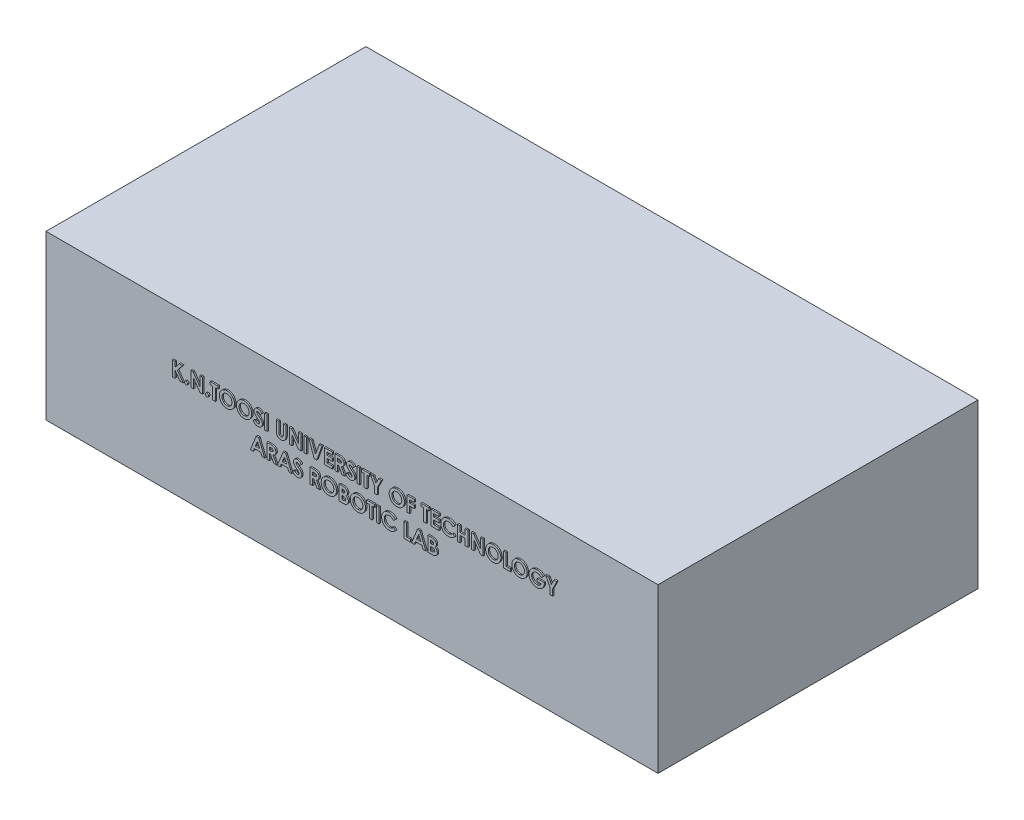
from build123d import *

# Parameters (mm, degrees)
SKETCH1_W           = 2200
SKETCH1_H           = 1150
BOSS_EXTRUDE1_DEPTH = 587.4322
SKETCH2_W           = 9.497863248
SKETCH2_H           = 52.916666666
SKETCH2_H_2         = 52.916666667
BOSS_EXTRUDE2_DEPTH = 5


with BuildPart() as part:
    # Sketch1 → Boss-Extrude1 (new body)
    with BuildSketch(Plane(origin=(0, 0, 0), x_dir=(1, 0, 0), z_dir=(0, 1, 0))):
        Rectangle(SKETCH1_W, SKETCH1_H)
    extrude(amount=BOSS_EXTRUDE1_DEPTH)

    # Sketch2 → Boss-Extrude2 (add)
    # profile 1 of 45: a face of its own
    with BuildSketch(Plane.XY.offset(575)):
        Polygon((-640.370310783, 419.889630527), (-630.872447535, 419.889630527), (-630.872447535, 401.264914315), (-615.862431509, 419.889630527), (-603.873499217, 419.889630527), (-622.731421894, 396.484181809), (-602.039648389, 366.972963861), (-613.477365403, 366.972963861), (-630.872447535, 391.788251654), (-630.872447535, 366.972963861), (-640.370310783, 366.972963861), align=None)
    # profile 2 of 45: a face of its own
    with BuildSketch(Plane.XY.offset(575)):
        with BuildLine():
            add(Edge.make_bspline(
                [(-591.184947535, 377.827664715), (-590.801530057, 377.806642856), (-590.046647262, 377.765254445), (-588.955944552, 377.456377072), (-587.971579072, 376.901434865), (-587.091424809, 376.177608939), (-586.347188527, 375.306749708), (-585.809271374, 374.31364123), (-585.474296871, 373.227141146), (-585.437315451, 372.469883398), (-585.418387706, 372.082305474)],
                knots=[0, 0, 0, 0, 1.016957001, 2.002212695, 2.9757545, 3.99499976, 5.013036768, 5.994806404, 6.97370641, 8, 8, 8, 8], degree=3))
            add(Edge.make_bspline(
                [(-585.418387706, 372.082305474), (-585.437191456, 371.694665303), (-585.473930612, 370.937285937), (-585.811589365, 369.848668728), (-586.346384708, 368.847397806), (-587.091484521, 367.967206746), (-587.967934048, 367.229739641), (-588.958207779, 366.679914813), (-590.044569494, 366.353515611), (-590.801164346, 366.314391026), (-591.184947535, 366.294545057)],
                knots=[0, 0, 0, 0, 1.023218912, 1.999186227, 2.986238111, 4.008388923, 5.030539734, 6.0011649, 6.986089706, 8, 8, 8, 8], degree=3))
            add(Edge.make_bspline(
                [(-591.184947535, 366.294545057), (-591.56882166, 366.314229646), (-592.325595786, 366.353036084), (-593.413646174, 366.682666037), (-594.411230875, 367.226068799), (-595.287900615, 367.968101292), (-596.036329202, 368.844280974), (-596.555919817, 369.851827917), (-596.896723768, 370.936875515), (-596.932960674, 371.694526357), (-596.951507364, 372.082305474)],
                knots=[0, 0, 0, 0, 1.013427518, 1.99788335, 2.976245624, 3.997909735, 5.019573847, 6.001765691, 6.977268297, 8, 8, 8, 8], degree=3))
            add(Edge.make_bspline(
                [(-596.951507364, 372.082305474), (-596.932838314, 372.470024763), (-596.896362339, 373.227558712), (-596.558231207, 374.310445651), (-596.035496465, 375.309883474), (-595.28796303, 376.176712532), (-594.407567075, 376.905077052), (-593.415922102, 377.453663545), (-592.323519067, 377.765737519), (-591.568456382, 377.806805571), (-591.184947535, 377.827664715)],
                knots=[0, 0, 0, 0, 1.025808215, 2.00424526, 2.981110158, 3.998665696, 5.017428914, 5.998734231, 6.983523959, 8, 8, 8, 8], degree=3))
        make_face()
    # profile 3 of 45: a face of its own
    with BuildSketch(Plane.XY.offset(575)):
        Polygon((-574.563686851, 419.889630527), (-566.009249752, 419.889630527), (-541.999584287, 385.067665383), (-541.999584287, 419.889630527), (-532.501721039, 419.889630527), (-532.501721039, 366.972963861), (-541.119759901, 366.972963861), (-565.065823603, 401.688926067), (-565.065823603, 366.972963861), (-574.563686851, 366.972963861), align=None)
    # profile 4 of 45: a face of its own
    with BuildSketch(Plane.XY.offset(575)):
        with BuildLine():
            add(Edge.make_bspline(
                [(-516.558879159, 377.827664715), (-516.17546168, 377.806642856), (-515.420578886, 377.765254445), (-514.329876176, 377.456377072), (-513.345510696, 376.901434865), (-512.465356432, 376.177608939), (-511.721120151, 375.306749708), (-511.183202998, 374.31364123), (-510.848228495, 373.227141146), (-510.811247075, 372.469883398), (-510.79231933, 372.082305474)],
                knots=[0, 0, 0, 0, 1.016957001, 2.002212695, 2.9757545, 3.99499976, 5.013036768, 5.994806404, 6.97370641, 8, 8, 8, 8], degree=3))
            add(Edge.make_bspline(
                [(-510.79231933, 372.082305474), (-510.81112308, 371.694665303), (-510.847862236, 370.937285937), (-511.185520989, 369.848668728), (-511.720316332, 368.847397806), (-512.465416145, 367.967206746), (-513.341865672, 367.229739641), (-514.332139403, 366.679914813), (-515.418501118, 366.353515611), (-516.17509597, 366.314391026), (-516.558879159, 366.294545057)],
                knots=[0, 0, 0, 0, 1.023218912, 1.999186227, 2.986238111, 4.008388923, 5.030539734, 6.0011649, 6.986089706, 8, 8, 8, 8], degree=3))
            add(Edge.make_bspline(
                [(-516.558879159, 366.294545057), (-516.942753284, 366.314229646), (-517.69952741, 366.353036084), (-518.787577798, 366.682666037), (-519.785162499, 367.226068799), (-520.661832239, 367.968101292), (-521.410260826, 368.844280974), (-521.929851441, 369.851827917), (-522.270655392, 370.936875515), (-522.306892298, 371.694526357), (-522.325438988, 372.082305474)],
                knots=[0, 0, 0, 0, 1.013427518, 1.99788335, 2.976245624, 3.997909735, 5.019573847, 6.001765691, 6.977268297, 8, 8, 8, 8], degree=3))
            add(Edge.make_bspline(
                [(-522.325438988, 372.082305474), (-522.306769938, 372.470024763), (-522.270293963, 373.227558712), (-521.932162831, 374.310445651), (-521.409428089, 375.309883474), (-520.661894654, 376.176712532), (-519.781498699, 376.905077052), (-518.789853726, 377.453663545), (-517.697450691, 377.765737519), (-516.942388006, 377.806805571), (-516.558879159, 377.827664715)],
                knots=[0, 0, 0, 0, 1.025808215, 2.00424526, 2.981110158, 3.998665696, 5.017428914, 5.998734231, 6.983523959, 8, 8, 8, 8], degree=3))
        make_face()
    # profile 5 of 45: a face of its own
    with BuildSketch(Plane.XY.offset(575)):
        Polygon((-505.364968902, 419.889630527), (-476.871379159, 419.889630527), (-476.871379159, 410.391767279), (-486.369242406, 410.391767279), (-486.369242406, 366.972963861), (-495.867105654, 366.972963861), (-495.867105654, 410.391767279), (-505.364968902, 410.391767279), align=None)
    # profile 6 of 45: a face of its own
    with BuildSketch(Plane.XY.offset(575)):
        with BuildLine():
            add(Edge.make_bspline(
                [(-444.540483058, 421.246468134), (-443.620461955, 421.22264714), (-441.804131918, 421.175619103), (-439.132965878, 420.783603708), (-436.558803503, 420.144870823), (-434.082808819, 419.256985913), (-431.711181434, 418.095900544), (-429.435555823, 416.694532247), (-427.264083171, 415.026431036), (-425.219014986, 413.130510959), (-423.329003148, 411.06878066), (-421.691306787, 408.848961446), (-420.29473941, 406.528571063), (-419.137260632, 404.101391958), (-418.2556251, 401.550614758), (-417.63694498, 398.889245054), (-417.239473655, 396.118039983), (-417.193758337, 394.231227048), (-417.170524458, 393.272292787)],
                knots=[0, 0, 0, 0, 1.014329547, 2.002516266, 2.970391464, 3.935626869, 4.897733899, 5.877609409, 6.878433252, 7.912639331, 8.949961323, 9.958554974, 10.949718813, 11.932905612, 12.9188844, 13.919928257, 14.942845884, 16, 16, 16, 16], degree=3))
            add(Edge.make_bspline(
                [(-417.170524458, 393.272292787), (-417.195267534, 392.3241635), (-417.24402456, 390.45584432), (-417.620718461, 387.710176995), (-418.249817231, 385.077316105), (-419.116499533, 382.551302112), (-420.252986022, 380.14437016), (-421.622318814, 377.841152324), (-423.260631998, 375.663023016), (-425.108169858, 373.611151104), (-427.142148707, 371.74863706), (-429.296455197, 370.107299775), (-431.561142073, 368.7164925), (-433.932894556, 367.576852291), (-436.416798755, 366.692419495), (-439.006719122, 366.068387892), (-441.702495396, 365.689151286), (-443.535753993, 365.640712736), (-444.466281002, 365.616126254)],
                knots=[0, 0, 0, 0, 1.051557043, 2.072126891, 3.067553643, 4.050577992, 5.02905126, 6.015227836, 7.017913613, 8.04756643, 9.074058332, 10.072836633, 11.047628519, 12.017157415, 12.98668631, 13.966869689, 14.968021931, 16, 16, 16, 16], degree=3))
            add(Edge.make_bspline(
                [(-444.466281002, 365.616126254), (-445.439500678, 365.63818154), (-447.351744314, 365.681517162), (-450.150321436, 366.093619149), (-452.831600137, 366.7143887), (-455.37305613, 367.640853954), (-457.800571974, 368.799013424), (-460.096311997, 370.225356247), (-462.259504678, 371.917525282), (-464.277741592, 373.832183452), (-466.106269123, 375.927239437), (-467.720303336, 378.140480298), (-469.081776999, 380.454998821), (-470.190739926, 382.87187825), (-471.06500175, 385.376098266), (-471.681694133, 387.982910294), (-472.045989039, 390.68606225), (-472.096733205, 392.522097095), (-472.122447535, 393.452497782)],
                knots=[0, 0, 0, 0, 1.067978421, 2.098431617, 3.099715153, 4.085208694, 5.062210972, 6.048429807, 7.046490867, 8.072918869, 9.098532598, 10.095778865, 11.076610158, 12.041847152, 13.011192615, 13.984257998, 14.978533688, 16, 16, 16, 16], degree=3))
            add(Edge.make_bspline(
                [(-472.122447535, 393.452497782), (-472.114376897, 394.078422656), (-472.098337813, 395.322346762), (-471.905130157, 397.16577879), (-471.626966681, 398.973229499), (-471.215576098, 400.737492558), (-470.715841688, 402.471014022), (-470.068365166, 404.157657844), (-469.331361661, 405.815442019), (-468.470242458, 407.424786039), (-467.512761168, 408.970882594), (-466.468063832, 410.446438478), (-465.333523575, 411.833612062), (-464.112795126, 413.14151928), (-462.801671689, 414.361563163), (-461.417399739, 415.511015131), (-459.933132461, 416.559341652), (-458.381355808, 417.532144951), (-456.770818341, 418.411834103), (-455.108076406, 419.160599201), (-453.427385774, 419.814483007), (-451.706294684, 420.330557019), (-449.963247688, 420.750893902), (-448.17962386, 421.028869896), (-446.371537228, 421.222072202), (-445.152282934, 421.238316858), (-444.540483058, 421.246468134)],
                knots=[0, 0, 0, 0, 1.034744296, 2.056386356, 3.06226378, 4.057406941, 5.050368692, 6.043467995, 7.042652155, 8.049140477, 9.059438543, 10.048523776, 11.036952808, 12.020949711, 13.004946614, 13.997082645, 14.994316842, 16.007702937, 17.024872941, 18.026463647, 19.021641123, 20.005082605, 20.995858141, 21.984425357, 22.988620895, 24, 24, 24, 24], degree=3))
        make_face()
        with BuildLine():
            add(Edge.make_bspline(
                [(-444.688887171, 411.748604886), (-445.308061252, 411.731991055), (-446.530063115, 411.699202002), (-448.322517303, 411.449393761), (-450.043336624, 411.050421605), (-451.682981897, 410.472515313), (-453.248559485, 409.736987276), (-454.742844675, 408.846407519), (-456.145144704, 407.770163359), (-457.474157888, 406.566033546), (-458.674702608, 405.224356208), (-459.735421741, 403.786520764), (-460.623072808, 402.254928375), (-461.366486137, 400.643807173), (-461.926111611, 398.935040527), (-462.324716057, 397.14201339), (-462.576619187, 395.261636287), (-462.60837189, 393.979785664), (-462.624584287, 393.325294256)],
                knots=[0, 0, 0, 0, 1.033739768, 2.040188636, 3.016340934, 3.979330865, 4.937572243, 5.900995986, 6.878200029, 7.884839167, 8.891893314, 9.879764717, 10.863503415, 11.843163062, 12.837761627, 13.859916423, 14.907309254, 16, 16, 16, 16], degree=3))
            add(Edge.make_bspline(
                [(-462.624584287, 393.325294256), (-462.603089124, 392.59997055), (-462.560962166, 391.178456267), (-462.264551765, 389.10478953), (-461.757423075, 387.146417108), (-461.025139107, 385.312917108), (-460.11691487, 383.583929886), (-458.989044511, 381.980646638), (-457.659794192, 380.493467652), (-456.635750516, 379.625190614), (-456.116003891, 379.184502322)],
                knots=[0, 0, 0, 0, 1.078454662, 2.113592447, 3.107694534, 4.079536787, 5.043276885, 6.005368276, 6.987637804, 8, 8, 8, 8], degree=3))
            add(Edge.make_bspline(
                [(-456.116003891, 379.184502322), (-455.69023218, 378.858938738), (-454.848281467, 378.215146571), (-453.504344822, 377.38999484), (-452.120354711, 376.682757492), (-450.685867193, 376.111318081), (-449.203911833, 375.661833446), (-447.674691852, 375.347066747), (-446.100374025, 375.149523422), (-445.03574653, 375.125913253), (-444.498081883, 375.113989502)],
                knots=[0, 0, 0, 0, 1.023928204, 2.024787132, 3.009472467, 3.9914905, 4.972207045, 5.96565515, 6.972602802, 8, 8, 8, 8], degree=3))
            add(Edge.make_bspline(
                [(-444.498081883, 375.113989502), (-443.889554516, 375.130744199), (-442.692257783, 375.163709594), (-440.933171098, 375.410442558), (-439.247912626, 375.828003818), (-437.62602014, 376.400840511), (-436.072170452, 377.145603739), (-434.593957651, 378.063806486), (-433.188790025, 379.144174406), (-431.861469986, 380.36411708), (-430.648236727, 381.7110797), (-429.589731095, 383.15658441), (-428.67385716, 384.668782415), (-427.945903122, 386.269076585), (-427.36416811, 387.942360892), (-426.970361077, 389.696045952), (-426.716329936, 391.522902409), (-426.684568287, 392.766142788), (-426.668387706, 393.399496313)],
                knots=[0, 0, 0, 0, 1.026359118, 2.019393844, 2.989460624, 3.950973911, 4.916101784, 5.890408035, 6.881132271, 7.902007068, 8.92769091, 9.933912415, 10.920395702, 11.90457117, 12.894218921, 13.903490204, 14.931958862, 16, 16, 16, 16], degree=3))
            add(Edge.make_bspline(
                [(-426.668387706, 393.399496313), (-426.685128137, 394.02920788), (-426.718079124, 395.268699063), (-426.965246354, 397.090858685), (-427.380159548, 398.83680174), (-427.95471641, 400.509379536), (-428.688395097, 402.110231822), (-429.595663224, 403.633729055), (-430.673337299, 405.078398384), (-431.89661472, 406.434394941), (-433.228077009, 407.680468918), (-434.657534813, 408.761834617), (-436.144990301, 409.701507027), (-437.724572957, 410.43760845), (-439.363965844, 411.024058893), (-441.073172623, 411.455929413), (-442.85866702, 411.697447087), (-444.073375776, 411.731400285), (-444.688887171, 411.748604886)],
                knots=[0, 0, 0, 0, 1.055025985, 2.07665775, 3.074803781, 4.057872707, 5.035505728, 6.020516407, 7.023567878, 8.050795229, 9.077271434, 10.074415901, 11.050397877, 12.019801805, 12.988065821, 13.964604439, 14.968634123, 16, 16, 16, 16], degree=3))
        make_face(mode=Mode.SUBTRACT)
    # profile 7 of 45: a face of its own
    with BuildSketch(Plane.XY.offset(575)):
        with BuildLine():
            add(Edge.make_bspline(
                [(-382.804371947, 421.246468134), (-381.884350844, 421.22264714), (-380.068020807, 421.175619103), (-377.396854767, 420.783603708), (-374.822692391, 420.144870823), (-372.346697708, 419.256985913), (-369.975070323, 418.095900544), (-367.699444712, 416.694532247), (-365.52797206, 415.026431036), (-363.482903875, 413.130510959), (-361.592892037, 411.06878066), (-359.955195675, 408.848961446), (-358.558628299, 406.528571063), (-357.401149521, 404.101391958), (-356.519513989, 401.550614758), (-355.900833869, 398.889245054), (-355.503362544, 396.118039983), (-355.457647226, 394.231227048), (-355.434413347, 393.272292787)],
                knots=[0, 0, 0, 0, 1.014329547, 2.002516266, 2.970391464, 3.935626869, 4.897733899, 5.877609409, 6.878433252, 7.912639331, 8.949961323, 9.958554974, 10.949718813, 11.932905612, 12.9188844, 13.919928257, 14.942845884, 16, 16, 16, 16], degree=3))
            add(Edge.make_bspline(
                [(-355.434413347, 393.272292787), (-355.459156423, 392.3241635), (-355.507913449, 390.45584432), (-355.88460735, 387.710176995), (-356.51370612, 385.077316105), (-357.380388422, 382.551302112), (-358.516874911, 380.14437016), (-359.886207703, 377.841152324), (-361.524520887, 375.663023016), (-363.372058747, 373.611151104), (-365.406037596, 371.74863706), (-367.560344086, 370.107299775), (-369.825030962, 368.7164925), (-372.196783445, 367.576852291), (-374.680687644, 366.692419495), (-377.270608011, 366.068387892), (-379.966384285, 365.689151286), (-381.799642882, 365.640712736), (-382.73016989, 365.616126254)],
                knots=[0, 0, 0, 0, 1.051557043, 2.072126891, 3.067553643, 4.050577992, 5.02905126, 6.015227836, 7.017913613, 8.04756643, 9.074058332, 10.072836633, 11.047628519, 12.017157415, 12.98668631, 13.966869689, 14.968021931, 16, 16, 16, 16], degree=3))
            add(Edge.make_bspline(
                [(-382.73016989, 365.616126254), (-383.703389567, 365.63818154), (-385.615633203, 365.681517162), (-388.414210325, 366.093619149), (-391.095489026, 366.7143887), (-393.636945019, 367.640853954), (-396.064460863, 368.799013424), (-398.360200886, 370.225356247), (-400.523393567, 371.917525282), (-402.54163048, 373.832183452), (-404.370158011, 375.927239437), (-405.984192225, 378.140480298), (-407.345665888, 380.454998821), (-408.454628815, 382.87187825), (-409.328890639, 385.376098266), (-409.945583022, 387.982910294), (-410.309877928, 390.68606225), (-410.360622093, 392.522097095), (-410.386336424, 393.452497782)],
                knots=[0, 0, 0, 0, 1.067978421, 2.098431617, 3.099715153, 4.085208694, 5.062210972, 6.048429807, 7.046490867, 8.072918869, 9.098532598, 10.095778865, 11.076610158, 12.041847152, 13.011192615, 13.984257998, 14.978533688, 16, 16, 16, 16], degree=3))
            add(Edge.make_bspline(
                [(-410.386336424, 393.452497782), (-410.378265785, 394.078422656), (-410.362226702, 395.322346762), (-410.169019046, 397.16577879), (-409.89085557, 398.973229499), (-409.479464987, 400.737492558), (-408.979730576, 402.471014022), (-408.332254055, 404.157657844), (-407.59525055, 405.815442019), (-406.734131347, 407.424786039), (-405.776650057, 408.970882594), (-404.731952721, 410.446438478), (-403.597412464, 411.833612062), (-402.376684014, 413.14151928), (-401.065560578, 414.361563163), (-399.681288628, 415.511015131), (-398.19702135, 416.559341652), (-396.645244697, 417.532144951), (-395.034707229, 418.411834103), (-393.371965295, 419.160599201), (-391.691274663, 419.814483007), (-389.970183573, 420.330557019), (-388.227136577, 420.750893902), (-386.443512749, 421.028869896), (-384.635426117, 421.222072202), (-383.416171823, 421.238316858), (-382.804371947, 421.246468134)],
                knots=[0, 0, 0, 0, 1.034744296, 2.056386356, 3.06226378, 4.057406941, 5.050368692, 6.043467995, 7.042652155, 8.049140477, 9.059438543, 10.048523776, 11.036952808, 12.020949711, 13.004946614, 13.997082645, 14.994316842, 16.007702937, 17.024872941, 18.026463647, 19.021641123, 20.005082605, 20.995858141, 21.984425357, 22.988620895, 24, 24, 24, 24], degree=3))
        make_face()
        with BuildLine():
            add(Edge.make_bspline(
                [(-382.95277606, 411.748604886), (-383.571950141, 411.731991055), (-384.793952004, 411.699202002), (-386.586406192, 411.449393761), (-388.307225513, 411.050421605), (-389.946870786, 410.472515313), (-391.512448374, 409.736987276), (-393.006733564, 408.846407519), (-394.409033593, 407.770163359), (-395.738046777, 406.566033546), (-396.938591497, 405.224356208), (-397.99931063, 403.786520764), (-398.886961697, 402.254928375), (-399.630375026, 400.643807173), (-400.1900005, 398.935040527), (-400.588604945, 397.14201339), (-400.840508076, 395.261636287), (-400.872260779, 393.979785664), (-400.888473176, 393.325294256)],
                knots=[0, 0, 0, 0, 1.033739768, 2.040188636, 3.016340934, 3.979330865, 4.937572243, 5.900995986, 6.878200029, 7.884839167, 8.891893314, 9.879764717, 10.863503415, 11.843163062, 12.837761627, 13.859916423, 14.907309254, 16, 16, 16, 16], degree=3))
            add(Edge.make_bspline(
                [(-400.888473176, 393.325294256), (-400.866978013, 392.59997055), (-400.824851055, 391.178456267), (-400.528440654, 389.10478953), (-400.021311964, 387.146417108), (-399.289027996, 385.312917108), (-398.380803759, 383.583929886), (-397.2529334, 381.980646638), (-395.923683081, 380.493467652), (-394.899639405, 379.625190614), (-394.37989278, 379.184502322)],
                knots=[0, 0, 0, 0, 1.078454662, 2.113592447, 3.107694534, 4.079536787, 5.043276885, 6.005368276, 6.987637804, 8, 8, 8, 8], degree=3))
            add(Edge.make_bspline(
                [(-394.37989278, 379.184502322), (-393.954121069, 378.858938738), (-393.112170356, 378.215146571), (-391.768233711, 377.38999484), (-390.3842436, 376.682757492), (-388.949756082, 376.111318081), (-387.467800722, 375.661833446), (-385.938580741, 375.347066747), (-384.364262914, 375.149523422), (-383.299635419, 375.125913253), (-382.761970772, 375.113989502)],
                knots=[0, 0, 0, 0, 1.023928204, 2.024787132, 3.009472467, 3.9914905, 4.972207045, 5.96565515, 6.972602802, 8, 8, 8, 8], degree=3))
            add(Edge.make_bspline(
                [(-382.761970772, 375.113989502), (-382.153443405, 375.130744199), (-380.956146672, 375.163709594), (-379.197059987, 375.410442558), (-377.511801515, 375.828003818), (-375.889909028, 376.400840511), (-374.336059341, 377.145603739), (-372.85784654, 378.063806486), (-371.452678914, 379.144174406), (-370.125358875, 380.36411708), (-368.912125616, 381.7110797), (-367.853619984, 383.15658441), (-366.937746049, 384.668782415), (-366.209792011, 386.269076585), (-365.628056999, 387.942360892), (-365.234249966, 389.696045952), (-364.980218825, 391.522902409), (-364.948457176, 392.766142788), (-364.932276594, 393.399496313)],
                knots=[0, 0, 0, 0, 1.026359118, 2.019393844, 2.989460624, 3.950973911, 4.916101784, 5.890408035, 6.881132271, 7.902007068, 8.92769091, 9.933912415, 10.920395702, 11.90457117, 12.894218921, 13.903490204, 14.931958862, 16, 16, 16, 16], degree=3))
            add(Edge.make_bspline(
                [(-364.932276594, 393.399496313), (-364.949017026, 394.02920788), (-364.981968013, 395.268699063), (-365.229135243, 397.090858685), (-365.644048437, 398.83680174), (-366.218605299, 400.509379536), (-366.952283986, 402.110231822), (-367.859552113, 403.633729055), (-368.937226188, 405.078398384), (-370.160503609, 406.434394941), (-371.491965897, 407.680468918), (-372.921423702, 408.761834617), (-374.40887919, 409.701507027), (-375.988461846, 410.43760845), (-377.627854733, 411.024058893), (-379.337061512, 411.455929413), (-381.122555909, 411.697447087), (-382.337264665, 411.731400285), (-382.95277606, 411.748604886)],
                knots=[0, 0, 0, 0, 1.055025985, 2.07665775, 3.074803781, 4.057872707, 5.035505728, 6.020516407, 7.023567878, 8.050795229, 9.077271434, 10.074415901, 11.050397877, 12.019801805, 12.988065821, 13.964604439, 14.968634123, 16, 16, 16, 16], degree=3))
        make_face(mode=Mode.SUBTRACT)
    # profile 8 of 45: a face of its own
    with BuildSketch(Plane.XY.offset(575)):
        with BuildLine():
            Line((-318.799797962, 412.81923456), (-325.90199481, 406.321254459))
            add(Edge.make_bspline(
                [(-325.90199481, 406.321254459), (-326.20622247, 406.7503992), (-326.79029715, 407.574297258), (-327.737021286, 408.677516176), (-328.679470477, 409.618644013), (-329.626375941, 410.393749173), (-330.58613069, 410.998122314), (-331.557068728, 411.426025175), (-332.533685536, 411.698047084), (-333.189821276, 411.731920357), (-333.513005761, 411.748604886)],
                knots=[0, 0, 0, 0, 1.299362458, 2.494594718, 3.587462134, 4.587049575, 5.512617175, 6.380583204, 7.202344345, 8, 8, 8, 8], degree=3))
            add(Edge.make_bspline(
                [(-333.513005761, 411.748604886), (-333.814462979, 411.738032803), (-334.396497664, 411.717620888), (-335.226231288, 411.514727972), (-335.962880615, 411.164564595), (-336.60572671, 410.706696522), (-337.114955661, 410.155071644), (-337.521535489, 409.576558982), (-337.750474097, 408.938011836), (-337.780606922, 408.499431898), (-337.795524458, 408.282308813)],
                knots=[0, 0, 0, 0, 1.185010067, 2.2879431, 3.333075148, 4.379039566, 5.372662701, 6.27520591, 7.14612461, 8, 8, 8, 8], degree=3))
            add(Edge.make_bspline(
                [(-337.795524458, 408.282308813), (-337.786176394, 408.062054715), (-337.767350693, 407.618493571), (-337.585520048, 406.968399474), (-337.311449346, 406.333181865), (-337.049563601, 405.94649468), (-336.915700072, 405.748838594)],
                knots=[0, 0, 0, 0, 0.967525499, 1.948461899, 2.951351359, 4, 4, 4, 4], degree=3))
            add(Edge.make_bspline(
                [(-336.915700072, 405.748838594), (-336.794003643, 405.595202586), (-336.513874536, 405.241552787), (-335.979725703, 404.681426633), (-335.308946948, 403.995223065), (-334.475725295, 403.206538614), (-333.514650064, 402.287009101), (-332.381174177, 401.272781583), (-331.107924014, 400.132446612), (-330.202927297, 399.338358632), (-329.728700873, 398.922249384)],
                knots=[0, 0, 0, 0, 0.473873513, 1.090794244, 1.870441696, 2.795289791, 3.865433203, 5.087734844, 6.473946851, 8, 8, 8, 8], degree=3))
            add(Edge.make_bspline(
                [(-329.728700873, 398.922249384), (-329.283571158, 398.537012068), (-328.438807437, 397.805911678), (-327.236876417, 396.768232059), (-326.18057923, 395.834657008), (-325.254528036, 395.019197489), (-324.472760869, 394.313297464), (-323.831991176, 393.713582739), (-323.324393042, 393.231728657), (-323.035853223, 392.940688499), (-322.912711958, 392.816480153)],
                knots=[0, 0, 0, 0, 1.543621617, 2.929473131, 4.163658386, 5.240097082, 6.164993805, 6.925417477, 7.541396219, 8, 8, 8, 8], degree=3))
            add(Edge.make_bspline(
                [(-322.912711958, 392.816480153), (-322.445539669, 392.310899683), (-321.547470465, 391.338996467), (-320.380297091, 389.832852139), (-319.41967565, 388.362548166), (-318.676520687, 386.900418394), (-318.115260169, 385.4253672), (-317.719564069, 383.901219033), (-317.482579041, 382.312047501), (-317.45626817, 381.22763193), (-317.442960355, 380.679143748)],
                knots=[0, 0, 0, 0, 1.206664779, 2.319633467, 3.337109185, 4.282041471, 5.190008762, 6.099243693, 7.03861361, 8, 8, 8, 8], degree=3))
            add(Edge.make_bspline(
                [(-317.442960355, 380.679143748), (-317.452432517, 380.144709282), (-317.471017252, 379.096128967), (-317.698644608, 377.561687868), (-318.023227858, 376.093161141), (-318.525090504, 374.706528433), (-319.136757725, 373.379028589), (-319.903570928, 372.131339838), (-320.80408789, 370.950835058), (-321.836218596, 369.858617216), (-322.977877717, 368.867505229), (-324.202415625, 367.985193929), (-325.521806469, 367.256733564), (-326.924777582, 366.656898415), (-328.410577984, 366.194897362), (-329.977437639, 365.853435526), (-331.627753166, 365.648495514), (-332.756262705, 365.627071468), (-333.332800766, 365.616126254)],
                knots=[0, 0, 0, 0, 1.043214005, 2.046824704, 3.02475056, 3.976699089, 4.921714032, 5.875962561, 6.831408892, 7.817874052, 8.806269674, 9.781291748, 10.760897367, 11.74438705, 12.757449933, 13.795994037, 14.874007457, 16, 16, 16, 16], degree=3))
            add(Edge.make_bspline(
                [(-333.332800766, 365.616126254), (-333.785378235, 365.62415528), (-334.681741177, 365.640057355), (-336.002844638, 365.769884567), (-337.278519372, 365.979411875), (-338.507328446, 366.279727097), (-339.694807862, 366.660267215), (-340.841006387, 367.125082392), (-341.938011432, 367.681377088), (-342.994123458, 368.317711672), (-344.004208457, 369.056579946), (-344.981038557, 369.882875988), (-345.914910953, 370.809308601), (-346.810310845, 371.833686808), (-347.661509215, 372.958911403), (-348.496368841, 374.169311549), (-349.277786048, 375.487350632), (-349.760502216, 376.41196571), (-350.007062919, 376.884238567)],
                knots=[0, 0, 0, 0, 1.016823716, 2.013894106, 2.979844003, 3.91962641, 4.853723003, 5.779685073, 6.695824784, 7.614987388, 8.547259901, 9.504950863, 10.487499108, 11.500346958, 12.559593716, 13.656357062, 14.802919212, 16, 16, 16, 16], degree=3))
            Line((-350.007062919, 376.884238567), (-341.654031402, 381.898177536))
            add(Edge.make_bspline(
                [(-341.654031402, 381.898177536), (-341.345620813, 381.362086137), (-340.754371355, 380.334353107), (-339.752443873, 378.953463526), (-338.726020318, 377.770960178), (-337.651370697, 376.807743887), (-336.541562347, 376.050935212), (-335.391234636, 375.51006723), (-334.199579366, 375.17527056), (-333.387877931, 375.134384154), (-332.982991071, 375.113989502)],
                knots=[0, 0, 0, 0, 1.283663364, 2.460892379, 3.537111102, 4.529833553, 5.449777664, 6.316464042, 7.160231139, 8, 8, 8, 8], degree=3))
            add(Edge.make_bspline(
                [(-332.982991071, 375.113989502), (-332.571163167, 375.130644881), (-331.772157055, 375.162958742), (-330.631678075, 375.461432133), (-329.586043763, 375.930057253), (-328.682205186, 376.598720678), (-327.916891666, 377.370459899), (-327.352046359, 378.22905507), (-326.997206727, 379.158034319), (-326.959691575, 379.803364412), (-326.940823603, 380.127928471)],
                knots=[0, 0, 0, 0, 1.13588714, 2.203786484, 3.234766741, 4.283437687, 5.291419208, 6.222934724, 7.106237994, 8, 8, 8, 8], degree=3))
            add(Edge.make_bspline(
                [(-326.940823603, 380.127928471), (-326.958247403, 380.429882511), (-326.993642184, 381.043273237), (-327.254349233, 381.955286612), (-327.66191387, 382.866885222), (-328.144091576, 383.614603065), (-328.634767768, 384.240646946), (-329.10396488, 384.783085649), (-329.675322845, 385.382385453), (-330.347392952, 386.039300231), (-331.111295399, 386.75961297), (-331.967673677, 387.543253134), (-332.926334222, 388.38331779), (-333.603917387, 388.955561535), (-333.958218101, 389.254781435)],
                knots=[0, 0, 0, 0, 0.916159276, 1.861089862, 2.860218735, 3.940849679, 4.552606315, 5.27541173, 6.11797699, 7.06649574, 8.129236253, 9.306560635, 10.591630461, 12, 12, 12, 12], degree=3))
            add(Edge.make_bspline(
                [(-333.958218101, 389.254781435), (-334.63175786, 389.824660658), (-335.924484522, 390.918431377), (-337.751271306, 392.533896296), (-339.397369767, 394.043696287), (-340.848562431, 395.466495777), (-342.123339736, 396.776018958), (-343.213068338, 397.982902278), (-344.105777072, 399.09645519), (-345.045160522, 400.415384098), (-345.937762617, 402.022589597), (-346.709224125, 403.95624413), (-347.209715791, 405.88965331), (-347.265788921, 407.187637744), (-347.293387706, 407.826496179)],
                knots=[0, 0, 0, 0, 1.345494975, 2.582412109, 3.71882943, 4.751509156, 5.681369928, 6.505683931, 7.230279997, 7.856715994, 8.973648664, 10.023341002, 11.027102913, 12, 12, 12, 12], degree=3))
            add(Edge.make_bspline(
                [(-347.293387706, 407.826496179), (-347.281909408, 408.279540291), (-347.259295929, 409.172085858), (-347.057580206, 410.484444065), (-346.756108374, 411.750759467), (-346.318284723, 412.966411967), (-345.750042489, 414.129878913), (-345.059934369, 415.246855963), (-344.23724429, 416.307062714), (-343.310128111, 417.309796323), (-342.28868345, 418.226180732), (-341.197140023, 419.034981794), (-340.041676062, 419.718106932), (-338.82936011, 420.284808837), (-337.552679951, 420.718583146), (-336.221040827, 421.026063997), (-334.832532747, 421.208943802), (-333.888099522, 421.233804189), (-333.407002823, 421.246468134)],
                knots=[0, 0, 0, 0, 1.010766082, 1.991317756, 2.957454644, 3.913069143, 4.869106762, 5.843196583, 6.838735724, 7.860187025, 8.887984031, 9.89767229, 10.887916223, 11.879572884, 12.879850636, 13.892031539, 14.926195476, 16, 16, 16, 16], degree=3))
            add(Edge.make_bspline(
                [(-333.407002823, 421.246468134), (-332.783525312, 421.223659998), (-331.541491803, 421.178223766), (-329.705109438, 420.82292728), (-327.911407922, 420.264186129), (-326.466009625, 419.590126404), (-325.315933179, 418.937164429), (-324.434507016, 418.335999294), (-323.537608451, 417.647332322), (-322.618004553, 416.86899334), (-321.692782987, 415.986317421), (-320.73563528, 415.02031736), (-319.759603738, 413.962644656), (-319.125337989, 413.207048181), (-318.799797962, 412.81923456)],
                knots=[0, 0, 0, 0, 1.282922637, 2.555718331, 3.837320111, 5.142675274, 5.830281639, 6.55870424, 7.337177975, 8.157850921, 9.037902056, 9.96903443, 10.957596896, 12, 12, 12, 12], degree=3))
        make_face()
    # profile 9 of 45: a face of its own
    with BuildSketch(Plane.XY.offset(575)):
        with Locations((-304.55300309, 393.431297194)):
            Rectangle(SKETCH2_W, SKETCH2_H)
    # profile 10 of 45: a face of its own
    with BuildSketch(Plane.XY.offset(575)):
        with BuildLine():
            Line((-267.239968902, 419.889630527), (-257.742105654, 419.889630527))
            Line((-257.742105654, 419.889630527), (-257.742105654, 385.459876254))
            add(Edge.make_bspline(
                [(-257.742105654, 385.459876254), (-257.741589207, 385.102923495), (-257.740591695, 384.413472929), (-257.690655727, 383.424337095), (-257.644960871, 382.515114161), (-257.562514383, 381.686799531), (-257.44071266, 380.939038881), (-257.322768849, 380.267028864), (-257.163143562, 379.682801058), (-256.923252278, 379.017796861), (-256.553658557, 378.270628322), (-255.949762924, 377.49191213), (-255.252919026, 376.781220579), (-254.417711478, 376.189667859), (-253.479012056, 375.711155027), (-252.441978498, 375.356629974), (-251.308072651, 375.159561117), (-250.524038958, 375.129474946), (-250.12049441, 375.113989502)],
                knots=[0, 0, 0, 0, 1.155499968, 2.231836252, 3.205919964, 4.102923608, 4.924856345, 5.658536265, 6.31071849, 6.882491295, 7.94666036, 8.992281882, 10.060072772, 11.158554251, 12.289267114, 13.461410017, 14.693379945, 16, 16, 16, 16], degree=3))
            add(Edge.make_bspline(
                [(-250.12049441, 375.113989502), (-249.691778127, 375.126499753), (-248.85585396, 375.150892625), (-247.653510121, 375.390335068), (-246.539531736, 375.771609441), (-245.537505526, 376.31578514), (-244.648428668, 376.968075086), (-243.895843739, 377.711890031), (-243.301906476, 378.548713517), (-242.914800266, 379.320746908), (-242.697459192, 380.031336413), (-242.534551231, 380.666221171), (-242.415121673, 381.415322342), (-242.306771252, 382.266941094), (-242.241660996, 383.229898559), (-242.171059539, 384.296450507), (-242.145183449, 385.473894573), (-242.140773058, 386.293770974), (-242.138473176, 386.721311216)],
                knots=[0, 0, 0, 0, 1.261321664, 2.459363699, 3.594844139, 4.716940403, 5.803436589, 6.833651888, 7.818396249, 8.814403945, 9.360733334, 10.004355033, 10.743453831, 11.592799886, 12.532235708, 13.585170094, 14.740740724, 16, 16, 16, 16], degree=3))
            Line((-242.138473176, 386.721311216), (-242.138473176, 419.889630527))
            Line((-242.138473176, 419.889630527), (-232.640609928, 419.889630527))
            Line((-232.640609928, 419.889630527), (-232.640609928, 388.321955581))
            add(Edge.make_bspline(
                [(-232.640609928, 388.321955581), (-232.641928879, 387.682395995), (-232.644465093, 386.452585286), (-232.683413694, 384.685260752), (-232.766328221, 383.071093282), (-232.83596686, 381.60961122), (-232.970741474, 380.302783424), (-233.111145006, 379.145029367), (-233.290101386, 378.140451866), (-233.556377719, 376.996862463), (-234.01589184, 375.680061147), (-234.756688845, 374.163821516), (-235.697082697, 372.679331073), (-236.808581233, 371.242920238), (-238.063564751, 369.908540863), (-239.434207582, 368.737128492), (-240.898733618, 367.746239943), (-242.472446105, 366.960103637), (-244.154005736, 366.346976582), (-245.960050286, 365.934986083), (-247.889348176, 365.65664013), (-249.221950694, 365.629901576), (-249.908488534, 365.616126254)],
                knots=[0, 0, 0, 0, 1.170808336, 2.251350247, 3.235597562, 4.129743112, 4.929140599, 5.639994148, 6.264258765, 6.79612947, 7.788252245, 8.809469599, 9.879094798, 10.999557536, 12.129761673, 13.226370002, 14.293821979, 15.358369427, 16.438775801, 17.562147481, 18.744053101, 20, 20, 20, 20], degree=3))
            add(Edge.make_bspline(
                [(-249.908488534, 365.616126254), (-250.364637932, 365.623809488), (-251.264611338, 365.638968351), (-252.588180113, 365.77262993), (-253.867669334, 365.969596838), (-255.100674849, 366.256951274), (-256.29147619, 366.628159534), (-257.439756988, 367.08509105), (-258.541249956, 367.625197117), (-259.589791292, 368.243509927), (-260.584090678, 368.912108791), (-261.492828992, 369.653278777), (-262.347278052, 370.412207565), (-263.122753182, 371.2208341), (-263.825078891, 372.070669183), (-264.452808737, 372.963638819), (-265.005010124, 373.89966369), (-265.495573373, 374.89561559), (-265.915447636, 376.002115158), (-266.269417412, 377.25852104), (-266.578653739, 378.684526144), (-266.80845993, 380.283343182), (-267.016803573, 382.049702632), (-267.148673612, 383.988206131), (-267.217660765, 386.098909296), (-267.232344961, 387.562216042), (-267.239968902, 388.321955581)],
                knots=[0, 0, 0, 0, 1.001158378, 1.975264943, 2.917723546, 3.841610987, 4.75185031, 5.653588123, 6.552117133, 7.442167995, 8.324307438, 9.179605724, 10.014504199, 10.831958861, 11.636465792, 12.43274043, 13.225645099, 14.020104002, 14.867201867, 15.819789774, 16.883317127, 18.068162734, 19.364263498, 20.787406516, 22.332041935, 24, 24, 24, 24], degree=3))
            Line((-267.239968902, 388.321955581), (-267.239968902, 419.889630527))
        make_face()
    # profile 11 of 45: a face of its own
    with BuildSketch(Plane.XY.offset(575)):
        Polygon((-220.429071466, 419.889630527), (-211.874634367, 419.889630527), (-187.864968902, 385.067665383), (-187.864968902, 419.889630527), (-178.367105654, 419.889630527), (-178.367105654, 366.972963861), (-186.985144516, 366.972963861), (-210.931208218, 401.688926067), (-210.931208218, 366.972963861), (-220.429071466, 366.972963861), align=None)
    # profile 12 of 45: a face of its own
    with BuildSketch(Plane.XY.offset(575)):
        with Locations((-162.763473176, 393.431297194)):
            Rectangle(SKETCH2_W, SKETCH2_H)
    # profile 13 of 45: a face of its own
    with BuildSketch(Plane.XY.offset(575)):
        Polygon((-150.212725312, 419.889630527), (-140.068244143, 419.889630527), (-126.468067193, 382.3009887), (-112.836089362, 419.889630527), (-102.723409073, 419.889630527), (-121.909940857, 366.972963861), (-131.05799441, 366.972963861), align=None)
    # profile 14 of 45: a face of its own
    with BuildSketch(Plane.XY.offset(575)):
        Polygon((-94.24317403, 419.889630527), (-65.749584287, 419.889630527), (-65.749584287, 410.391767279), (-84.745310783, 410.391767279), (-84.745310783, 400.215485228), (-65.749584287, 400.215485228), (-65.749584287, 390.71762198), (-84.745310783, 390.71762198), (-84.745310783, 376.470827108), (-65.749584287, 376.470827108), (-65.749584287, 366.972963861), (-94.24317403, 366.972963861), align=None)
    # profile 15 of 45: a face of its own
    with BuildSketch(Plane.XY.offset(575)):
        with BuildLine():
            Line((-56.251721039, 419.889630527), (-45.185014308, 419.889630527))
            add(Edge.make_bspline(
                [(-45.185014308, 419.889630527), (-44.453508362, 419.887034101), (-43.046616373, 419.882040442), (-41.017954968, 419.803253728), (-39.154350481, 419.69361555), (-37.453043677, 419.52630478), (-35.914762404, 419.304470923), (-34.537964943, 419.042965514), (-33.322691537, 418.744924035), (-32.258693033, 418.373540838), (-31.298486998, 417.954626222), (-30.403441478, 417.473285646), (-29.55381044, 416.934878991), (-28.755272748, 416.32523932), (-28.000888923, 415.6553339), (-27.289235775, 414.924488406), (-26.630369621, 414.126505569), (-26.028370189, 413.266427628), (-25.479696164, 412.361645356), (-24.994783402, 411.410916482), (-24.600451539, 410.413579838), (-24.252017066, 409.384049093), (-24.001051003, 408.307606905), (-23.826507778, 407.194732619), (-23.698714056, 406.041508799), (-23.691366528, 405.258059739), (-23.687618475, 404.858413914)],
                knots=[0, 0, 0, 0, 1.749336639, 3.364467119, 4.854658419, 6.213483162, 7.451590619, 8.570285859, 9.5643256, 10.440900261, 11.26203566, 12.067320669, 12.869050712, 13.665104639, 14.467235401, 15.27997916, 16.102287765, 16.939272006, 17.78853747, 18.631303466, 19.488103222, 20.351255419, 21.228522269, 22.127379805, 23.044756219, 24, 24, 24, 24], degree=3))
            add(Edge.make_bspline(
                [(-23.687618475, 404.858413914), (-23.69735457, 404.441275481), (-23.716445277, 403.62334304), (-23.819278213, 402.421866995), (-24.007224518, 401.272378754), (-24.291896538, 400.178243878), (-24.61909005, 399.125844584), (-25.054173491, 398.134598295), (-25.545208157, 397.190088771), (-26.128395682, 396.305676456), (-26.768415501, 395.461716788), (-27.512745087, 394.69054499), (-28.313163316, 393.9507135), (-29.214664613, 393.288562851), (-30.177509962, 392.65932081), (-31.220830087, 392.089059947), (-32.337815924, 391.563445217), (-33.123112284, 391.270326136), (-33.524691124, 391.120433145)],
                knots=[0, 0, 0, 0, 1.099860209, 2.156625411, 3.176576793, 4.16617041, 5.135385252, 6.078461593, 7.016046972, 7.938469504, 8.868247731, 9.803980173, 10.76021508, 11.73834243, 12.748633912, 13.790971185, 14.870363756, 16, 16, 16, 16], degree=3))
            Line((-33.524691124, 391.120433145), (-21.313152663, 366.972963861))
            Line((-21.313152663, 366.972963861), (-31.871045291, 366.972963861))
            Line((-31.871045291, 366.972963861), (-43.531368475, 390.039203177))
            Line((-43.531368475, 390.039203177), (-46.753857791, 390.039203177))
            Line((-46.753857791, 390.039203177), (-46.753857791, 366.972963861))
            Line((-46.753857791, 366.972963861), (-56.251721039, 366.972963861))
            Line((-56.251721039, 366.972963861), (-56.251721039, 419.889630527))
        make_face()
        with BuildLine():
            Line((-46.753857791, 399.537066425), (-43.054355254, 399.537066425))
            add(Edge.make_bspline(
                [(-43.054355254, 399.537066425), (-42.602060316, 399.542160474), (-41.736012697, 399.551914485), (-40.490522474, 399.597157628), (-39.359320317, 399.706171247), (-38.337548463, 399.84390588), (-37.42006545, 400.002940404), (-36.615054901, 400.230846534), (-35.910112833, 400.475053721), (-35.313592836, 400.778539906), (-34.803939858, 401.123669523), (-34.36388713, 401.515745346), (-33.999900429, 401.969523188), (-33.700320808, 402.472671324), (-33.467280434, 403.029639976), (-33.297178814, 403.634314889), (-33.202117163, 404.293584088), (-33.191179996, 404.748569604), (-33.185481723, 404.98561744)],
                knots=[0, 0, 0, 0, 1.688639943, 3.233382647, 4.650958383, 5.928841754, 7.082724185, 8.122798841, 9.049171256, 9.863274652, 10.613301712, 11.341792392, 12.054588806, 12.776240173, 13.521029143, 14.301969904, 15.115324896, 16, 16, 16, 16], degree=3))
            add(Edge.make_bspline(
                [(-33.185481723, 404.98561744), (-33.19625483, 405.266062334), (-33.217416603, 405.81694436), (-33.427407133, 406.610021314), (-33.761666699, 407.344068297), (-34.219845011, 408.015768701), (-34.796861029, 408.604627644), (-35.459032434, 409.123711492), (-36.220650484, 409.534164159), (-36.925851486, 409.804894368), (-37.567419562, 409.966875045), (-38.14641451, 410.087581613), (-38.816894146, 410.173129822), (-39.579364645, 410.263868925), (-40.431882445, 410.322708641), (-41.379094276, 410.365649905), (-42.418279753, 410.383219286), (-43.142690729, 410.388835908), (-43.520768181, 410.391767279)],
                knots=[0, 0, 0, 0, 1.020303359, 2.004196876, 2.966617323, 3.9489082, 4.950758222, 5.960522915, 7.003732012, 8.091992268, 8.70421221, 9.413913587, 10.24622431, 11.166358409, 12.212345909, 13.359657661, 14.621978493, 16, 16, 16, 16], degree=3))
            Line((-43.520768181, 410.391767279), (-46.753857791, 410.391767279))
            Line((-46.753857791, 410.391767279), (-46.753857791, 399.537066425))
        make_face(mode=Mode.SUBTRACT)
    # profile 16 of 45: a face of its own
    with BuildSketch(Plane.XY.offset(575)):
        with BuildLine():
            Line((13.625415713, 412.81923456), (6.523218865, 406.321254459))
            add(Edge.make_bspline(
                [(6.523218865, 406.321254459), (6.218991205, 406.7503992), (5.634916525, 407.574297258), (4.688192389, 408.677516176), (3.745743199, 409.618644013), (2.798837734, 410.393749173), (1.839082986, 410.998122314), (0.868144948, 411.426025175), (-0.10847186, 411.698047084), (-0.764607601, 411.731920357), (-1.087792086, 411.748604886)],
                knots=[0, 0, 0, 0, 1.299362458, 2.494594718, 3.587462134, 4.587049575, 5.512617175, 6.380583204, 7.202344345, 8, 8, 8, 8], degree=3))
            add(Edge.make_bspline(
                [(-1.087792086, 411.748604886), (-1.389249304, 411.738032803), (-1.971283989, 411.717620888), (-2.801017613, 411.514727972), (-3.53766694, 411.164564595), (-4.180513035, 410.706696522), (-4.689741986, 410.155071644), (-5.096321814, 409.576558982), (-5.325260421, 408.938011836), (-5.355393247, 408.499431898), (-5.370310783, 408.282308813)],
                knots=[0, 0, 0, 0, 1.185010067, 2.2879431, 3.333075148, 4.379039566, 5.372662701, 6.27520591, 7.14612461, 8, 8, 8, 8], degree=3))
            add(Edge.make_bspline(
                [(-5.370310783, 408.282308813), (-5.360962719, 408.062054715), (-5.342137018, 407.618493571), (-5.160306373, 406.968399474), (-4.886235671, 406.333181865), (-4.624349926, 405.94649468), (-4.490486397, 405.748838594)],
                knots=[0, 0, 0, 0, 0.967525499, 1.948461899, 2.951351359, 4, 4, 4, 4], degree=3))
            add(Edge.make_bspline(
                [(-4.490486397, 405.748838594), (-4.368789968, 405.595202586), (-4.088660861, 405.241552787), (-3.554512028, 404.681426633), (-2.883733273, 403.995223065), (-2.05051162, 403.206538614), (-1.089436388, 402.287009101), (0.044039498, 401.272781583), (1.317289661, 400.132446612), (2.222286378, 399.338358632), (2.696512802, 398.922249384)],
                knots=[0, 0, 0, 0, 0.473873513, 1.090794244, 1.870441696, 2.795289791, 3.865433203, 5.087734844, 6.473946851, 8, 8, 8, 8], degree=3))
            add(Edge.make_bspline(
                [(2.696512802, 398.922249384), (3.141642517, 398.537012068), (3.986406238, 397.805911678), (5.188337258, 396.768232059), (6.244634445, 395.834657008), (7.170685639, 395.019197489), (7.952452807, 394.313297464), (8.593222499, 393.713582739), (9.100820633, 393.231728657), (9.389360452, 392.940688499), (9.512501717, 392.816480153)],
                knots=[0, 0, 0, 0, 1.543621617, 2.929473131, 4.163658386, 5.240097082, 6.164993805, 6.925417477, 7.541396219, 8, 8, 8, 8], degree=3))
            add(Edge.make_bspline(
                [(9.512501717, 392.816480153), (9.979674007, 392.310899683), (10.87774321, 391.338996467), (12.044916584, 389.832852139), (13.005538025, 388.362548166), (13.748692988, 386.900418394), (14.309953506, 385.4253672), (14.705649607, 383.901219033), (14.942634634, 382.312047501), (14.968945505, 381.22763193), (14.98225332, 380.679143748)],
                knots=[0, 0, 0, 0, 1.206664779, 2.319633467, 3.337109185, 4.282041471, 5.190008762, 6.099243693, 7.03861361, 8, 8, 8, 8], degree=3))
            add(Edge.make_bspline(
                [(14.98225332, 380.679143748), (14.972781158, 380.144709282), (14.954196424, 379.096128967), (14.726569067, 377.561687868), (14.401985818, 376.093161141), (13.900123172, 374.706528433), (13.288455951, 373.379028589), (12.521642747, 372.131339838), (11.621125785, 370.950835058), (10.588995079, 369.858617216), (9.447335958, 368.867505229), (8.22279805, 367.985193929), (6.903407206, 367.256733564), (5.500436094, 366.656898415), (4.014635692, 366.194897362), (2.447776036, 365.853435526), (0.797460509, 365.648495514), (-0.33104903, 365.627071468), (-0.907587091, 365.616126254)],
                knots=[0, 0, 0, 0, 1.043214005, 2.046824704, 3.02475056, 3.976699089, 4.921714032, 5.875962561, 6.831408892, 7.817874052, 8.806269674, 9.781291748, 10.760897367, 11.74438705, 12.757449933, 13.795994037, 14.874007457, 16, 16, 16, 16], degree=3))
            add(Edge.make_bspline(
                [(-0.907587091, 365.616126254), (-1.36016456, 365.62415528), (-2.256527501, 365.640057355), (-3.577630963, 365.769884567), (-4.853305697, 365.979411875), (-6.082114771, 366.279727097), (-7.269594187, 366.660267215), (-8.415792711, 367.125082392), (-9.512797757, 367.681377088), (-10.568909783, 368.317711672), (-11.578994782, 369.056579946), (-12.555824881, 369.882875988), (-13.489697277, 370.809308601), (-14.38509717, 371.833686808), (-15.23629554, 372.958911403), (-16.071155166, 374.169311549), (-16.852572372, 375.487350632), (-17.335288541, 376.41196571), (-17.581849244, 376.884238567)],
                knots=[0, 0, 0, 0, 1.016823716, 2.013894106, 2.979844003, 3.91962641, 4.853723003, 5.779685073, 6.695824784, 7.614987388, 8.547259901, 9.504950863, 10.487499108, 11.500346958, 12.559593716, 13.656357062, 14.802919212, 16, 16, 16, 16], degree=3))
            Line((-17.581849244, 376.884238567), (-9.228817727, 381.898177536))
            add(Edge.make_bspline(
                [(-9.228817727, 381.898177536), (-8.920407138, 381.362086137), (-8.329157679, 380.334353107), (-7.327230198, 378.953463526), (-6.300806643, 377.770960178), (-5.226157022, 376.807743887), (-4.116348672, 376.050935212), (-2.966020961, 375.51006723), (-1.77436569, 375.17527056), (-0.962664256, 375.134384154), (-0.557777396, 375.113989502)],
                knots=[0, 0, 0, 0, 1.283663364, 2.460892379, 3.537111102, 4.529833553, 5.449777664, 6.316464042, 7.160231139, 8, 8, 8, 8], degree=3))
            add(Edge.make_bspline(
                [(-0.557777396, 375.113989502), (-0.145949492, 375.130644881), (0.65305662, 375.162958742), (1.7935356, 375.461432133), (2.839169912, 375.930057253), (3.743008489, 376.598720678), (4.50832201, 377.370459899), (5.073167317, 378.22905507), (5.428006948, 379.158034319), (5.4655221, 379.803364412), (5.484390072, 380.127928471)],
                knots=[0, 0, 0, 0, 1.13588714, 2.203786484, 3.234766741, 4.283437687, 5.291419208, 6.222934724, 7.106237994, 8, 8, 8, 8], degree=3))
            add(Edge.make_bspline(
                [(5.484390072, 380.127928471), (5.466966272, 380.429882511), (5.431571491, 381.043273237), (5.170864443, 381.955286612), (4.763299806, 382.866885222), (4.2811221, 383.614603065), (3.790445907, 384.240646946), (3.321248795, 384.783085649), (2.74989083, 385.382385453), (2.077820724, 386.039300231), (1.313918276, 386.75961297), (0.457539998, 387.543253134), (-0.501120547, 388.38331779), (-1.178703712, 388.955561535), (-1.533004426, 389.254781435)],
                knots=[0, 0, 0, 0, 0.916159276, 1.861089862, 2.860218735, 3.940849679, 4.552606315, 5.27541173, 6.11797699, 7.06649574, 8.129236253, 9.306560635, 10.591630461, 12, 12, 12, 12], degree=3))
            add(Edge.make_bspline(
                [(-1.533004426, 389.254781435), (-2.206544184, 389.824660658), (-3.499270847, 390.918431377), (-5.326057631, 392.533896296), (-6.972156092, 394.043696287), (-8.423348756, 395.466495777), (-9.698126061, 396.776018958), (-10.787854663, 397.982902278), (-11.680563397, 399.09645519), (-12.619946847, 400.415384098), (-13.512548941, 402.022589597), (-14.28401045, 403.95624413), (-14.784502116, 405.88965331), (-14.840575246, 407.187637744), (-14.86817403, 407.826496179)],
                knots=[0, 0, 0, 0, 1.345494975, 2.582412109, 3.71882943, 4.751509156, 5.681369928, 6.505683931, 7.230279997, 7.856715994, 8.973648664, 10.023341002, 11.027102913, 12, 12, 12, 12], degree=3))
            add(Edge.make_bspline(
                [(-14.86817403, 407.826496179), (-14.856695733, 408.279540291), (-14.834082254, 409.172085858), (-14.632366531, 410.484444065), (-14.330894698, 411.750759467), (-13.893071048, 412.966411967), (-13.324828814, 414.129878913), (-12.634720693, 415.246855963), (-11.812030615, 416.307062714), (-10.884914436, 417.309796323), (-9.863469775, 418.226180732), (-8.771926348, 419.034981794), (-7.616462387, 419.718106932), (-6.404146435, 420.284808837), (-5.127466276, 420.718583146), (-3.795827152, 421.026063997), (-2.407319072, 421.208943802), (-1.462885847, 421.233804189), (-0.981789148, 421.246468134)],
                knots=[0, 0, 0, 0, 1.010766082, 1.991317756, 2.957454644, 3.913069143, 4.869106762, 5.843196583, 6.838735724, 7.860187025, 8.887984031, 9.89767229, 10.887916223, 11.879572884, 12.879850636, 13.892031539, 14.926195476, 16, 16, 16, 16], degree=3))
            add(Edge.make_bspline(
                [(-0.981789148, 421.246468134), (-0.358311637, 421.223659998), (0.883721872, 421.178223766), (2.720104237, 420.82292728), (4.513805753, 420.264186129), (5.959204051, 419.590126404), (7.109280496, 418.937164429), (7.990706659, 418.335999294), (8.887605225, 417.647332322), (9.807209122, 416.86899334), (10.732430688, 415.986317421), (11.689578396, 415.02031736), (12.665609938, 413.962644656), (13.299875687, 413.207048181), (13.625415713, 412.81923456)],
                knots=[0, 0, 0, 0, 1.282922637, 2.555718331, 3.837320111, 5.142675274, 5.830281639, 6.55870424, 7.337177975, 8.157850921, 9.037902056, 9.96903443, 10.957596896, 12, 12, 12, 12], degree=3))
        make_face()
    # profile 17 of 45: a face of its own
    with BuildSketch(Plane.XY.offset(575)):
        with Locations((27.872210585, 393.431297194)):
            Rectangle(SKETCH2_W, SKETCH2_H)
    # profile 18 of 45: a face of its own
    with BuildSketch(Plane.XY.offset(575)):
        Polygon((39.405330243, 419.889630527), (67.898919987, 419.889630527), (67.898919987, 410.391767279), (58.401056739, 410.391767279), (58.401056739, 366.972963861), (48.903193491, 366.972963861), (48.903193491, 410.391767279), (39.405330243, 410.391767279), align=None)
    # profile 19 of 45: a face of its own
    with BuildSketch(Plane.XY.offset(575)):
        Polygon((70.951804602, 419.889630527), (81.520297524, 419.889630527), (90.965159303, 401.328516077), (100.410021082, 419.889630527), (110.978514004, 419.889630527), (95.714090927, 389.890799064), (95.714090927, 366.972963861), (86.216227679, 366.972963861), (86.216227679, 389.890799064), align=None)
    # profile 20 of 45: a face of its own
    with BuildSketch(Plane.XY.offset(575)):
        with BuildLine():
            add(Edge.make_bspline(
                [(166.036440019, 421.246468134), (166.956461121, 421.22264714), (168.772791159, 421.175619103), (171.443957198, 420.783603708), (174.018119574, 420.144870823), (176.494114258, 419.256985913), (178.865741643, 418.095900544), (181.141367253, 416.694532247), (183.312839906, 415.026431036), (185.357908091, 413.130510959), (187.247919929, 411.06878066), (188.88561629, 408.848961446), (190.282183667, 406.528571063), (191.439662445, 404.101391958), (192.321297977, 401.550614758), (192.939978097, 398.889245054), (193.337449422, 396.118039983), (193.38316474, 394.231227048), (193.406398619, 393.272292787)],
                knots=[0, 0, 0, 0, 1.014329547, 2.002516266, 2.970391464, 3.935626869, 4.897733899, 5.877609409, 6.878433252, 7.912639331, 8.949961323, 9.958554974, 10.949718813, 11.932905612, 12.9188844, 13.919928257, 14.942845884, 16, 16, 16, 16], degree=3))
            add(Edge.make_bspline(
                [(193.406398619, 393.272292787), (193.381655543, 392.3241635), (193.332898517, 390.45584432), (192.956204616, 387.710176995), (192.327105846, 385.077316105), (191.460423544, 382.551302112), (190.323937055, 380.14437016), (188.954604263, 377.841152324), (187.316291079, 375.663023016), (185.468753219, 373.611151104), (183.43477437, 371.74863706), (181.28046788, 370.107299775), (179.015781004, 368.7164925), (176.644028521, 367.576852291), (174.160124322, 366.692419495), (171.570203955, 366.068387892), (168.874427681, 365.689151286), (167.041169084, 365.640712736), (166.110642075, 365.616126254)],
                knots=[0, 0, 0, 0, 1.051557043, 2.072126891, 3.067553643, 4.050577992, 5.02905126, 6.015227836, 7.017913613, 8.04756643, 9.074058332, 10.072836633, 11.047628519, 12.017157415, 12.98668631, 13.966869689, 14.968021931, 16, 16, 16, 16], degree=3))
            add(Edge.make_bspline(
                [(166.110642075, 365.616126254), (165.137422399, 365.63818154), (163.225178763, 365.681517162), (160.426601641, 366.093619149), (157.74532294, 366.7143887), (155.203866947, 367.640853954), (152.776351103, 368.799013424), (150.48061108, 370.225356247), (148.317418399, 371.917525282), (146.299181485, 373.832183452), (144.470653954, 375.927239437), (142.856619741, 378.140480298), (141.495146078, 380.454998821), (140.386183151, 382.87187825), (139.511921327, 385.376098266), (138.895228944, 387.982910294), (138.530934038, 390.68606225), (138.480189872, 392.522097095), (138.454475542, 393.452497782)],
                knots=[0, 0, 0, 0, 1.067978421, 2.098431617, 3.099715153, 4.085208694, 5.062210972, 6.048429807, 7.046490867, 8.072918869, 9.098532598, 10.095778865, 11.076610158, 12.041847152, 13.011192615, 13.984257998, 14.978533688, 16, 16, 16, 16], degree=3))
            add(Edge.make_bspline(
                [(138.454475542, 393.452497782), (138.46254618, 394.078422656), (138.478585264, 395.322346762), (138.67179292, 397.16577879), (138.949956396, 398.973229499), (139.361346979, 400.737492558), (139.861081389, 402.471014022), (140.508557911, 404.157657844), (141.245561415, 405.815442019), (142.106680618, 407.424786039), (143.064161909, 408.970882594), (144.108859245, 410.446438478), (145.243399502, 411.833612062), (146.464127951, 413.14151928), (147.775251388, 414.361563163), (149.159523338, 415.511015131), (150.643790616, 416.559341652), (152.195567269, 417.532144951), (153.806104736, 418.411834103), (155.468846671, 419.160599201), (157.149537303, 419.814483007), (158.870628393, 420.330557019), (160.613675389, 420.750893902), (162.397299217, 421.028869896), (164.205385849, 421.222072202), (165.424640143, 421.238316858), (166.036440019, 421.246468134)],
                knots=[0, 0, 0, 0, 1.034744296, 2.056386356, 3.06226378, 4.057406941, 5.050368692, 6.043467995, 7.042652155, 8.049140477, 9.059438543, 10.048523776, 11.036952808, 12.020949711, 13.004946614, 13.997082645, 14.994316842, 16.007702937, 17.024872941, 18.026463647, 19.021641123, 20.005082605, 20.995858141, 21.984425357, 22.988620895, 24, 24, 24, 24], degree=3))
        make_face()
        with BuildLine():
            add(Edge.make_bspline(
                [(165.888035906, 411.748604886), (165.268861825, 411.731991055), (164.046859961, 411.699202002), (162.254405774, 411.449393761), (160.533586453, 411.050421605), (158.89394118, 410.472515313), (157.328363592, 409.736987276), (155.834078402, 408.846407519), (154.431778373, 407.770163359), (153.102765189, 406.566033546), (151.902220469, 405.224356208), (150.841501336, 403.786520764), (149.953850269, 402.254928375), (149.21043694, 400.643807173), (148.650811466, 398.935040527), (148.25220702, 397.14201339), (148.00030389, 395.261636287), (147.968551187, 393.979785664), (147.95233879, 393.325294256)],
                knots=[0, 0, 0, 0, 1.033739768, 2.040188636, 3.016340934, 3.979330865, 4.937572243, 5.900995986, 6.878200029, 7.884839167, 8.891893314, 9.879764717, 10.863503415, 11.843163062, 12.837761627, 13.859916423, 14.907309254, 16, 16, 16, 16], degree=3))
            add(Edge.make_bspline(
                [(147.95233879, 393.325294256), (147.973833953, 392.59997055), (148.015960911, 391.178456267), (148.312371312, 389.10478953), (148.819500001, 387.146417108), (149.55178397, 385.312917108), (150.460008207, 383.583929886), (151.587878565, 381.980646638), (152.917128884, 380.493467652), (153.941172561, 379.625190614), (154.460919185, 379.184502322)],
                knots=[0, 0, 0, 0, 1.078454662, 2.113592447, 3.107694534, 4.079536787, 5.043276885, 6.005368276, 6.987637804, 8, 8, 8, 8], degree=3))
            add(Edge.make_bspline(
                [(154.460919185, 379.184502322), (154.886690897, 378.858938738), (155.72864161, 378.215146571), (157.072578255, 377.38999484), (158.456568366, 376.682757492), (159.891055884, 376.111318081), (161.373011244, 375.661833446), (162.902231225, 375.347066747), (164.476549052, 375.149523422), (165.541176547, 375.125913253), (166.078841194, 375.113989502)],
                knots=[0, 0, 0, 0, 1.023928204, 2.024787132, 3.009472467, 3.9914905, 4.972207045, 5.96565515, 6.972602802, 8, 8, 8, 8], degree=3))
            add(Edge.make_bspline(
                [(166.078841194, 375.113989502), (166.687368561, 375.130744199), (167.884665294, 375.163709594), (169.643751979, 375.410442558), (171.329010451, 375.828003818), (172.950902937, 376.400840511), (174.504752625, 377.145603739), (175.982965426, 378.063806486), (177.388133051, 379.144174406), (178.71545309, 380.36411708), (179.92868635, 381.7110797), (180.987191982, 383.15658441), (181.903065917, 384.668782415), (182.631019955, 386.269076585), (183.212754966, 387.942360892), (183.606562, 389.696045952), (183.860593141, 391.522902409), (183.89235479, 392.766142788), (183.908535371, 393.399496313)],
                knots=[0, 0, 0, 0, 1.026359118, 2.019393844, 2.989460624, 3.950973911, 4.916101784, 5.890408035, 6.881132271, 7.902007068, 8.92769091, 9.933912415, 10.920395702, 11.90457117, 12.894218921, 13.903490204, 14.931958862, 16, 16, 16, 16], degree=3))
            add(Edge.make_bspline(
                [(183.908535371, 393.399496313), (183.891794939, 394.02920788), (183.858843952, 395.268699063), (183.611676723, 397.090858685), (183.196763529, 398.83680174), (182.622206667, 400.509379536), (181.888527979, 402.110231822), (180.981259852, 403.633729055), (179.903585778, 405.078398384), (178.680308357, 406.434394941), (177.348846068, 407.680468918), (175.919388263, 408.761834617), (174.431932776, 409.701507027), (172.852350119, 410.43760845), (171.212957233, 411.024058893), (169.503750454, 411.455929413), (167.718256057, 411.697447087), (166.503547301, 411.731400285), (165.888035906, 411.748604886)],
                knots=[0, 0, 0, 0, 1.055025985, 2.07665775, 3.074803781, 4.057872707, 5.035505728, 6.020516407, 7.023567878, 8.050795229, 9.077271434, 10.074415901, 11.050397877, 12.019801805, 12.988065821, 13.964604439, 14.968634123, 16, 16, 16, 16], degree=3))
        make_face(mode=Mode.SUBTRACT)
    # profile 21 of 45: a face of its own
    with BuildSketch(Plane.XY.offset(575)):
        Polygon((202.904261867, 419.889630527), (228.684176397, 419.889630527), (228.684176397, 410.391767279), (212.402125115, 410.391767279), (212.402125115, 400.215485228), (228.684176397, 400.215485228), (228.684176397, 390.71762198), (212.402125115, 390.71762198), (212.402125115, 366.972963861), (202.904261867, 366.972963861), align=None)
    # profile 22 of 45: a face of its own
    with BuildSketch(Plane.XY.offset(575)):
        Polygon((253.10725332, 419.889630527), (281.600843064, 419.889630527), (281.600843064, 410.391767279), (272.102979816, 410.391767279), (272.102979816, 366.972963861), (262.605116568, 366.972963861), (262.605116568, 410.391767279), (253.10725332, 410.391767279), align=None)
    # profile 23 of 45: a face of its own
    with BuildSketch(Plane.XY.offset(575)):
        Polygon((289.063449901, 419.889630527), (317.557039645, 419.889630527), (317.557039645, 410.391767279), (298.561313149, 410.391767279), (298.561313149, 400.215485228), (317.557039645, 400.215485228), (317.557039645, 390.71762198), (298.561313149, 390.71762198), (298.561313149, 376.470827108), (317.557039645, 376.470827108), (317.557039645, 366.972963861), (289.063449901, 366.972963861), align=None)
    # profile 24 of 45: a face of its own
    with BuildSketch(Plane.XY.offset(575)):
        with BuildLine():
            Line((374.544219132, 410.709776094), (367.579826103, 404.052791585))
            add(Edge.make_bspline(
                [(367.579826103, 404.052791585), (366.989049549, 404.663655532), (365.835077854, 405.856864199), (363.975595184, 407.436567319), (362.041800911, 408.753036129), (360.071313144, 409.861757778), (358.02868852, 410.700584724), (355.937545341, 411.31185205), (353.784531043, 411.684518634), (352.327453777, 411.727158286), (351.594583048, 411.748604886)],
                knots=[0, 0, 0, 0, 1.115251505, 2.178435587, 3.19620269, 4.182487026, 5.141301733, 6.088180966, 7.038406374, 8, 8, 8, 8], degree=3))
            add(Edge.make_bspline(
                [(351.594583048, 411.748604886), (350.982546927, 411.731661323), (349.774761076, 411.698225066), (348.001414946, 411.453104329), (346.305117725, 411.036265849), (344.680062718, 410.461785208), (343.131031719, 409.71843775), (341.654776992, 408.806798805), (340.254938182, 407.735101771), (338.950006349, 406.508891657), (337.756300568, 405.169164961), (336.701585503, 403.739679773), (335.81809245, 402.223710963), (335.093024073, 400.636611149), (334.528223835, 398.971034447), (334.124885505, 397.228102189), (333.891605394, 395.405738678), (333.856786774, 394.166909542), (333.839090927, 393.537300132)],
                knots=[0, 0, 0, 0, 1.035432265, 2.043311493, 3.022114605, 3.98653278, 4.95457646, 5.923598177, 6.917315552, 7.932509744, 8.948865224, 9.949768934, 10.933144597, 11.912367597, 12.897413939, 13.903909035, 14.934704909, 16, 16, 16, 16], degree=3))
            add(Edge.make_bspline(
                [(333.839090927, 393.537300132), (333.844190668, 393.095396195), (333.854242363, 392.224394457), (333.964275939, 390.935941148), (334.141455942, 389.685836834), (334.397879304, 388.475975089), (334.718539238, 387.305307437), (335.094746356, 386.163734586), (335.56669265, 385.067030504), (336.090560158, 384.002457685), (336.699812032, 382.99906433), (337.356697945, 382.042245492), (338.06898347, 381.136691401), (338.841282122, 380.28610399), (339.684463044, 379.503776036), (340.576733129, 378.766182006), (341.533143738, 378.091786376), (342.5338278, 377.463664447), (343.587429959, 376.918009583), (344.665363548, 376.423751693), (345.78397221, 376.0223408), (346.929636215, 375.698767001), (348.098261362, 375.42361581), (349.301277892, 375.254196766), (350.528257156, 375.125897706), (351.357489192, 375.117975989), (351.774788042, 375.113989502)],
                knots=[0, 0, 0, 0, 1.103660481, 2.175337485, 3.227646561, 4.255952547, 5.262355991, 6.258840057, 7.255597736, 8.242457506, 9.22035537, 10.185017736, 11.140346927, 12.096287581, 13.051739095, 14.01125915, 14.986044842, 15.97314143, 16.960198552, 17.947847494, 18.933482797, 19.925264591, 20.920966487, 21.929612487, 22.958107872, 24, 24, 24, 24], degree=3))
            add(Edge.make_bspline(
                [(351.774788042, 375.113989502), (352.482598608, 375.134463139), (353.873262311, 375.174688513), (355.914261254, 375.489245243), (357.859129914, 376.006673263), (359.413070667, 376.617725689), (360.630542201, 377.221147893), (361.557385282, 377.779283716), (362.515813265, 378.403619914), (363.489907482, 379.117719611), (364.49062456, 379.913013324), (365.500299536, 380.80691947), (366.544780267, 381.770003002), (367.22900924, 382.457374639), (367.579826103, 382.809802803)],
                knots=[0, 0, 0, 0, 1.404581149, 2.759636711, 4.088442092, 5.392261763, 6.066678138, 6.783632037, 7.538459478, 8.336747902, 9.180226004, 10.074962426, 11.012997595, 12, 12, 12, 12], degree=3))
            Line((367.579826103, 382.809802803), (374.332213256, 375.718206248))
            add(Edge.make_bspline(
                [(374.332213256, 375.718206248), (373.857556784, 375.259940327), (372.93112886, 374.365503251), (371.533638055, 373.095486066), (370.137906048, 371.954234444), (368.777650816, 370.900325952), (367.430589959, 369.964463503), (366.096866332, 369.145712442), (364.791578268, 368.423365369), (363.487621044, 367.809604313), (362.176880763, 367.288457431), (360.828283047, 366.839784173), (359.437705106, 366.460222737), (357.996653924, 366.153966507), (356.518570749, 365.908390355), (354.989622685, 365.742627873), (353.419504019, 365.631191271), (352.354468203, 365.621177769), (351.817189217, 365.616126254)],
                knots=[0, 0, 0, 0, 1.244526981, 2.429050516, 3.560637417, 4.644440555, 5.67424972, 6.652764056, 7.595344123, 8.486817594, 9.369275933, 10.254498637, 11.166417451, 12.086725134, 13.032340136, 13.991389299, 14.986715468, 16, 16, 16, 16], degree=3))
            add(Edge.make_bspline(
                [(351.817189217, 365.616126254), (350.830274274, 365.641284684), (348.899156061, 365.690512738), (346.06915267, 366.055259291), (343.380725415, 366.666750462), (340.827333856, 367.531567641), (338.409789913, 368.636331056), (336.128712067, 369.990719127), (333.987776907, 371.591133459), (332.004278977, 373.418815642), (330.210110701, 375.437337181), (328.624273719, 377.604675551), (327.312469309, 379.931482428), (326.22324984, 382.38338344), (325.371494541, 384.971567564), (324.772003206, 387.698834428), (324.402301276, 390.562550686), (324.361855359, 392.518534904), (324.341227679, 393.516099544)],
                knots=[0, 0, 0, 0, 1.078019885, 2.10938526, 3.111377082, 4.085535484, 5.04941344, 6.010039228, 6.978205633, 7.964457913, 8.951525778, 9.924444315, 10.892603023, 11.863865945, 12.85144698, 13.863884204, 14.910567087, 16, 16, 16, 16], degree=3))
            add(Edge.make_bspline(
                [(324.341227679, 393.516099544), (324.349943937, 394.166702692), (324.367217429, 395.456039117), (324.548763436, 397.355336129), (324.801849126, 399.206810985), (325.203346559, 400.991239238), (325.687312116, 402.732660429), (326.289186872, 404.412147343), (327.00800955, 406.034526995), (327.820610801, 407.602515346), (328.739898467, 409.105840391), (329.766843709, 410.531586201), (330.875008952, 411.890759269), (332.091021601, 413.165327641), (333.3972114, 414.366482277), (334.799475645, 415.487713889), (336.289380417, 416.545102203), (337.870958335, 417.511379741), (339.513483554, 418.385429133), (341.196239509, 419.156378027), (342.915091863, 419.800713766), (344.662773152, 420.335166493), (346.446667309, 420.734097664), (348.25404135, 421.036075691), (350.100273859, 421.204883338), (351.339859044, 421.232518227), (351.965593331, 421.246468134)],
                knots=[0, 0, 0, 0, 1.071919942, 2.124283339, 3.142214191, 4.149696895, 5.136002878, 6.119640489, 7.086990633, 8.058538607, 9.028339693, 9.988281803, 10.952401235, 11.916291999, 12.888973767, 13.874849856, 14.873389453, 15.898127285, 16.927174885, 17.938320013, 18.946391617, 19.950418109, 20.947802303, 21.956882652, 22.968648068, 24, 24, 24, 24], degree=3))
            add(Edge.make_bspline(
                [(351.965593331, 421.246468134), (352.499408836, 421.2384717), (353.561489651, 421.222561971), (355.143106209, 421.089937073), (356.712073739, 420.881651013), (358.262774855, 420.567391704), (359.806301756, 420.194326192), (361.32237077, 419.705848363), (362.834898704, 419.161347769), (364.320163806, 418.510508489), (365.780239286, 417.800058625), (367.180920578, 416.994027455), (368.54572499, 416.142017235), (369.844409276, 415.193602268), (371.101300589, 414.183183329), (372.309826535, 413.106046245), (373.459381592, 411.944231979), (374.180778518, 411.123341617), (374.544219132, 410.709776094)],
                knots=[0, 0, 0, 0, 0.996412454, 1.982464992, 2.961075852, 3.949442424, 4.934965278, 5.923860011, 6.921385422, 7.934793307, 8.949617135, 9.951082467, 10.950285876, 11.951772932, 12.951063433, 13.960125323, 14.972308753, 16, 16, 16, 16], degree=3))
        make_face()
    # profile 25 of 45: a face of its own
    with BuildSketch(Plane.XY.offset(575)):
        Polygon((384.04208238, 419.889630527), (393.539945628, 419.889630527), (393.539945628, 399.537066425), (411.85725332, 399.537066425), (411.85725332, 419.889630527), (421.355116568, 419.889630527), (421.355116568, 366.972963861), (411.85725332, 366.972963861), (411.85725332, 390.039203177), (393.539945628, 390.039203177), (393.539945628, 366.972963861), (384.04208238, 366.972963861), align=None)
    # profile 26 of 45: a face of its own
    with BuildSketch(Plane.XY.offset(575)):
        Polygon((433.566655029, 419.889630527), (442.121092129, 419.889630527), (466.130757594, 385.067665383), (466.130757594, 419.889630527), (475.628620841, 419.889630527), (475.628620841, 366.972963861), (467.010581979, 366.972963861), (443.064518277, 401.688926067), (443.064518277, 366.972963861), (433.566655029, 366.972963861), align=None)
    # profile 27 of 45: a face of its own
    with BuildSketch(Plane.XY.offset(575)):
        with BuildLine():
            add(Edge.make_bspline(
                [(512.708448566, 421.246468134), (513.628469668, 421.22264714), (515.444799706, 421.175619103), (518.115965745, 420.783603708), (520.690128121, 420.144870823), (523.166122805, 419.256985913), (525.53775019, 418.095900544), (527.813375801, 416.694532247), (529.984848453, 415.026431036), (532.029916638, 413.130510959), (533.919928476, 411.06878066), (535.557624837, 408.848961446), (536.954192214, 406.528571063), (538.111670992, 404.101391958), (538.993306524, 401.550614758), (539.611986644, 398.889245054), (540.009457969, 396.118039983), (540.055173287, 394.231227048), (540.078407166, 393.272292787)],
                knots=[0, 0, 0, 0, 1.014329547, 2.002516266, 2.970391464, 3.935626869, 4.897733899, 5.877609409, 6.878433252, 7.912639331, 8.949961323, 9.958554974, 10.949718813, 11.932905612, 12.9188844, 13.919928257, 14.942845884, 16, 16, 16, 16], degree=3))
            add(Edge.make_bspline(
                [(540.078407166, 393.272292787), (540.05366409, 392.3241635), (540.004907064, 390.45584432), (539.628213163, 387.710176995), (538.999114393, 385.077316105), (538.132432091, 382.551302112), (536.995945602, 380.14437016), (535.62661281, 377.841152324), (533.988299626, 375.663023016), (532.140761766, 373.611151104), (530.106782917, 371.74863706), (527.952476427, 370.107299775), (525.687789551, 368.7164925), (523.316037068, 367.576852291), (520.832132869, 366.692419495), (518.242212502, 366.068387892), (515.546436228, 365.689151286), (513.713177631, 365.640712736), (512.782650622, 365.616126254)],
                knots=[0, 0, 0, 0, 1.051557043, 2.072126891, 3.067553643, 4.050577992, 5.02905126, 6.015227836, 7.017913613, 8.04756643, 9.074058332, 10.072836633, 11.047628519, 12.017157415, 12.98668631, 13.966869689, 14.968021931, 16, 16, 16, 16], degree=3))
            add(Edge.make_bspline(
                [(512.782650622, 365.616126254), (511.809430946, 365.63818154), (509.89718731, 365.681517162), (507.098610188, 366.093619149), (504.417331487, 366.7143887), (501.875875494, 367.640853954), (499.44835965, 368.799013424), (497.152619627, 370.225356247), (494.989426946, 371.917525282), (492.971190032, 373.832183452), (491.142662501, 375.927239437), (489.528628288, 378.140480298), (488.167154625, 380.454998821), (487.058191698, 382.87187825), (486.183929874, 385.376098266), (485.567237491, 387.982910294), (485.202942585, 390.68606225), (485.152198419, 392.522097095), (485.126484089, 393.452497782)],
                knots=[0, 0, 0, 0, 1.067978421, 2.098431617, 3.099715153, 4.085208694, 5.062210972, 6.048429807, 7.046490867, 8.072918869, 9.098532598, 10.095778865, 11.076610158, 12.041847152, 13.011192615, 13.984257998, 14.978533688, 16, 16, 16, 16], degree=3))
            add(Edge.make_bspline(
                [(485.126484089, 393.452497782), (485.134554727, 394.078422656), (485.150593811, 395.322346762), (485.343801467, 397.16577879), (485.621964943, 398.973229499), (486.033355526, 400.737492558), (486.533089936, 402.471014022), (487.180566458, 404.157657844), (487.917569962, 405.815442019), (488.778689165, 407.424786039), (489.736170456, 408.970882594), (490.780867792, 410.446438478), (491.915408049, 411.833612062), (493.136136498, 413.14151928), (494.447259935, 414.361563163), (495.831531885, 415.511015131), (497.315799163, 416.559341652), (498.867575816, 417.532144951), (500.478113283, 418.411834103), (502.140855218, 419.160599201), (503.82154585, 419.814483007), (505.54263694, 420.330557019), (507.285683936, 420.750893902), (509.069307764, 421.028869896), (510.877394396, 421.222072202), (512.09664869, 421.238316858), (512.708448566, 421.246468134)],
                knots=[0, 0, 0, 0, 1.034744296, 2.056386356, 3.06226378, 4.057406941, 5.050368692, 6.043467995, 7.042652155, 8.049140477, 9.059438543, 10.048523776, 11.036952808, 12.020949711, 13.004946614, 13.997082645, 14.994316842, 16.007702937, 17.024872941, 18.026463647, 19.021641123, 20.005082605, 20.995858141, 21.984425357, 22.988620895, 24, 24, 24, 24], degree=3))
        make_face()
        with BuildLine():
            add(Edge.make_bspline(
                [(512.560044453, 411.748604886), (511.940870372, 411.731991055), (510.718868509, 411.699202002), (508.926414321, 411.449393761), (507.205595, 411.050421605), (505.565949727, 410.472515313), (504.000372139, 409.736987276), (502.506086949, 408.846407519), (501.10378692, 407.770163359), (499.774773736, 406.566033546), (498.574229016, 405.224356208), (497.513509883, 403.786520764), (496.625858816, 402.254928375), (495.882445487, 400.643807173), (495.322820013, 398.935040527), (494.924215567, 397.14201339), (494.672312437, 395.261636287), (494.640559734, 393.979785664), (494.624347337, 393.325294256)],
                knots=[0, 0, 0, 0, 1.033739768, 2.040188636, 3.016340934, 3.979330865, 4.937572243, 5.900995986, 6.878200029, 7.884839167, 8.891893314, 9.879764717, 10.863503415, 11.843163062, 12.837761627, 13.859916423, 14.907309254, 16, 16, 16, 16], degree=3))
            add(Edge.make_bspline(
                [(494.624347337, 393.325294256), (494.6458425, 392.59997055), (494.687969458, 391.178456267), (494.984379859, 389.10478953), (495.491508548, 387.146417108), (496.223792517, 385.312917108), (497.132016754, 383.583929886), (498.259887112, 381.980646638), (499.589137431, 380.493467652), (500.613181108, 379.625190614), (501.132927732, 379.184502322)],
                knots=[0, 0, 0, 0, 1.078454662, 2.113592447, 3.107694534, 4.079536787, 5.043276885, 6.005368276, 6.987637804, 8, 8, 8, 8], degree=3))
            add(Edge.make_bspline(
                [(501.132927732, 379.184502322), (501.558699444, 378.858938738), (502.400650157, 378.215146571), (503.744586802, 377.38999484), (505.128576913, 376.682757492), (506.563064431, 376.111318081), (508.045019791, 375.661833446), (509.574239772, 375.347066747), (511.148557599, 375.149523422), (512.213185094, 375.125913253), (512.750849741, 375.113989502)],
                knots=[0, 0, 0, 0, 1.023928204, 2.024787132, 3.009472467, 3.9914905, 4.972207045, 5.96565515, 6.972602802, 8, 8, 8, 8], degree=3))
            add(Edge.make_bspline(
                [(512.750849741, 375.113989502), (513.359377108, 375.130744199), (514.556673841, 375.163709594), (516.315760526, 375.410442558), (518.001018998, 375.828003818), (519.622911484, 376.400840511), (521.176761172, 377.145603739), (522.654973973, 378.063806486), (524.060141598, 379.144174406), (525.387461637, 380.36411708), (526.600694897, 381.7110797), (527.659200529, 383.15658441), (528.575074464, 384.668782415), (529.303028502, 386.269076585), (529.884763513, 387.942360892), (530.278570547, 389.696045952), (530.532601688, 391.522902409), (530.564363337, 392.766142788), (530.580543918, 393.399496313)],
                knots=[0, 0, 0, 0, 1.026359118, 2.019393844, 2.989460624, 3.950973911, 4.916101784, 5.890408035, 6.881132271, 7.902007068, 8.92769091, 9.933912415, 10.920395702, 11.90457117, 12.894218921, 13.903490204, 14.931958862, 16, 16, 16, 16], degree=3))
            add(Edge.make_bspline(
                [(530.580543918, 393.399496313), (530.563803486, 394.02920788), (530.530852499, 395.268699063), (530.28368527, 397.090858685), (529.868772076, 398.83680174), (529.294215214, 400.509379536), (528.560536526, 402.110231822), (527.653268399, 403.633729055), (526.575594325, 405.078398384), (525.352316904, 406.434394941), (524.020854615, 407.680468918), (522.59139681, 408.761834617), (521.103941323, 409.701507027), (519.524358666, 410.43760845), (517.88496578, 411.024058893), (516.175759001, 411.455929413), (514.390264604, 411.697447087), (513.175555848, 411.731400285), (512.560044453, 411.748604886)],
                knots=[0, 0, 0, 0, 1.055025985, 2.07665775, 3.074803781, 4.057872707, 5.035505728, 6.020516407, 7.023567878, 8.050795229, 9.077271434, 10.074415901, 11.050397877, 12.019801805, 12.988065821, 13.964604439, 14.968634123, 16, 16, 16, 16], degree=3))
        make_face(mode=Mode.SUBTRACT)
    # profile 28 of 45: a face of its own
    with BuildSketch(Plane.XY.offset(575)):
        Polygon((549.576270414, 419.889630527), (559.074133662, 419.889630527), (559.074133662, 376.470827108), (573.999347337, 376.470827108), (573.999347337, 366.972963861), (549.576270414, 366.972963861), align=None)
    # profile 29 of 45: a face of its own
    with BuildSketch(Plane.XY.offset(575)):
        with BuildLine():
            add(Edge.make_bspline(
                [(607.008662241, 421.246468134), (607.928683344, 421.22264714), (609.745013381, 421.175619103), (612.416179421, 420.783603708), (614.990341797, 420.144870823), (617.46633648, 419.256985913), (619.837963865, 418.095900544), (622.113589476, 416.694532247), (624.285062128, 415.026431036), (626.330130313, 413.130510959), (628.220142151, 411.06878066), (629.857838513, 408.848961446), (631.254405889, 406.528571063), (632.411884667, 404.101391958), (633.293520199, 401.550614758), (633.912200319, 398.889245054), (634.309671644, 396.118039983), (634.355386962, 394.231227048), (634.378620841, 393.272292787)],
                knots=[0, 0, 0, 0, 1.014329547, 2.002516266, 2.970391464, 3.935626869, 4.897733899, 5.877609409, 6.878433252, 7.912639331, 8.949961323, 9.958554974, 10.949718813, 11.932905612, 12.9188844, 13.919928257, 14.942845884, 16, 16, 16, 16], degree=3))
            add(Edge.make_bspline(
                [(634.378620841, 393.272292787), (634.353877765, 392.3241635), (634.305120739, 390.45584432), (633.928426838, 387.710176995), (633.299328068, 385.077316105), (632.432645766, 382.551302112), (631.296159277, 380.14437016), (629.926826485, 377.841152324), (628.288513301, 375.663023016), (626.440975441, 373.611151104), (624.406996592, 371.74863706), (622.252690102, 370.107299775), (619.988003226, 368.7164925), (617.616250743, 367.576852291), (615.132346545, 366.692419495), (612.542426177, 366.068387892), (609.846649903, 365.689151286), (608.013391306, 365.640712736), (607.082864298, 365.616126254)],
                knots=[0, 0, 0, 0, 1.051557043, 2.072126891, 3.067553643, 4.050577992, 5.02905126, 6.015227836, 7.017913613, 8.04756643, 9.074058332, 10.072836633, 11.047628519, 12.017157415, 12.98668631, 13.966869689, 14.968021931, 16, 16, 16, 16], degree=3))
            add(Edge.make_bspline(
                [(607.082864298, 365.616126254), (606.109644621, 365.63818154), (604.197400985, 365.681517162), (601.398823863, 366.093619149), (598.717545163, 366.7143887), (596.176089169, 367.640853954), (593.748573325, 368.799013424), (591.452833302, 370.225356247), (589.289640621, 371.917525282), (587.271403708, 373.832183452), (585.442876177, 375.927239437), (583.828841963, 378.140480298), (582.4673683, 380.454998821), (581.358405373, 382.87187825), (580.484143549, 385.376098266), (579.867451167, 387.982910294), (579.50315626, 390.68606225), (579.452412095, 392.522097095), (579.426697764, 393.452497782)],
                knots=[0, 0, 0, 0, 1.067978421, 2.098431617, 3.099715153, 4.085208694, 5.062210972, 6.048429807, 7.046490867, 8.072918869, 9.098532598, 10.095778865, 11.076610158, 12.041847152, 13.011192615, 13.984257998, 14.978533688, 16, 16, 16, 16], degree=3))
            add(Edge.make_bspline(
                [(579.426697764, 393.452497782), (579.434768403, 394.078422656), (579.450807486, 395.322346762), (579.644015142, 397.16577879), (579.922178618, 398.973229499), (580.333569201, 400.737492558), (580.833303612, 402.471014022), (581.480780133, 404.157657844), (582.217783638, 405.815442019), (583.078902841, 407.424786039), (584.036384131, 408.970882594), (585.081081467, 410.446438478), (586.215621724, 411.833612062), (587.436350174, 413.14151928), (588.74747361, 414.361563163), (590.13174556, 415.511015131), (591.616012838, 416.559341652), (593.167789491, 417.532144951), (594.778326959, 418.411834103), (596.441068893, 419.160599201), (598.121759525, 419.814483007), (599.842850615, 420.330557019), (601.585897611, 420.750893902), (603.369521439, 421.028869896), (605.177608071, 421.222072202), (606.396862365, 421.238316858), (607.008662241, 421.246468134)],
                knots=[0, 0, 0, 0, 1.034744296, 2.056386356, 3.06226378, 4.057406941, 5.050368692, 6.043467995, 7.042652155, 8.049140477, 9.059438543, 10.048523776, 11.036952808, 12.020949711, 13.004946614, 13.997082645, 14.994316842, 16.007702937, 17.024872941, 18.026463647, 19.021641123, 20.005082605, 20.995858141, 21.984425357, 22.988620895, 24, 24, 24, 24], degree=3))
        make_face()
        with BuildLine():
            add(Edge.make_bspline(
                [(606.860258128, 411.748604886), (606.241084047, 411.731991055), (605.019082184, 411.699202002), (603.226627996, 411.449393761), (601.505808675, 411.050421605), (599.866163403, 410.472515313), (598.300585814, 409.736987276), (596.806300624, 408.846407519), (595.404000595, 407.770163359), (594.074987411, 406.566033546), (592.874442691, 405.224356208), (591.813723558, 403.786520764), (590.926072491, 402.254928375), (590.182659162, 400.643807173), (589.623033688, 398.935040527), (589.224429243, 397.14201339), (588.972526112, 395.261636287), (588.940773409, 393.979785664), (588.924561012, 393.325294256)],
                knots=[0, 0, 0, 0, 1.033739768, 2.040188636, 3.016340934, 3.979330865, 4.937572243, 5.900995986, 6.878200029, 7.884839167, 8.891893314, 9.879764717, 10.863503415, 11.843163062, 12.837761627, 13.859916423, 14.907309254, 16, 16, 16, 16], degree=3))
            add(Edge.make_bspline(
                [(588.924561012, 393.325294256), (588.946056175, 392.59997055), (588.988183133, 391.178456267), (589.284593534, 389.10478953), (589.791722224, 387.146417108), (590.524006192, 385.312917108), (591.432230429, 383.583929886), (592.560100788, 381.980646638), (593.889351107, 380.493467652), (594.913394783, 379.625190614), (595.433141408, 379.184502322)],
                knots=[0, 0, 0, 0, 1.078454662, 2.113592447, 3.107694534, 4.079536787, 5.043276885, 6.005368276, 6.987637804, 8, 8, 8, 8], degree=3))
            add(Edge.make_bspline(
                [(595.433141408, 379.184502322), (595.858913119, 378.858938738), (596.700863832, 378.215146571), (598.044800477, 377.38999484), (599.428790588, 376.682757492), (600.863278106, 376.111318081), (602.345233466, 375.661833446), (603.874453447, 375.347066747), (605.448771274, 375.149523422), (606.513398769, 375.125913253), (607.051063416, 375.113989502)],
                knots=[0, 0, 0, 0, 1.023928204, 2.024787132, 3.009472467, 3.9914905, 4.972207045, 5.96565515, 6.972602802, 8, 8, 8, 8], degree=3))
            add(Edge.make_bspline(
                [(607.051063416, 375.113989502), (607.659590783, 375.130744199), (608.856887516, 375.163709594), (610.615974201, 375.410442558), (612.301232673, 375.828003818), (613.92312516, 376.400840511), (615.476974847, 377.145603739), (616.955187648, 378.063806486), (618.360355274, 379.144174406), (619.687675313, 380.36411708), (620.900908572, 381.7110797), (621.959414204, 383.15658441), (622.875288139, 384.668782415), (623.603242177, 386.269076585), (624.184977189, 387.942360892), (624.578784222, 389.696045952), (624.832815363, 391.522902409), (624.864577012, 392.766142788), (624.880757594, 393.399496313)],
                knots=[0, 0, 0, 0, 1.026359118, 2.019393844, 2.989460624, 3.950973911, 4.916101784, 5.890408035, 6.881132271, 7.902007068, 8.92769091, 9.933912415, 10.920395702, 11.90457117, 12.894218921, 13.903490204, 14.931958862, 16, 16, 16, 16], degree=3))
            add(Edge.make_bspline(
                [(624.880757594, 393.399496313), (624.864017162, 394.02920788), (624.831066175, 395.268699063), (624.583898945, 397.090858685), (624.168985751, 398.83680174), (623.594428889, 400.509379536), (622.860750202, 402.110231822), (621.953482075, 403.633729055), (620.875808, 405.078398384), (619.652530579, 406.434394941), (618.321068291, 407.680468918), (616.891610486, 408.761834617), (615.404154998, 409.701507027), (613.824572342, 410.43760845), (612.185179455, 411.024058893), (610.475972676, 411.455929413), (608.690478279, 411.697447087), (607.475769523, 411.731400285), (606.860258128, 411.748604886)],
                knots=[0, 0, 0, 0, 1.055025985, 2.07665775, 3.074803781, 4.057872707, 5.035505728, 6.020516407, 7.023567878, 8.050795229, 9.077271434, 10.074415901, 11.050397877, 12.019801805, 12.988065821, 13.964604439, 14.968634123, 16, 16, 16, 16], degree=3))
        make_face(mode=Mode.SUBTRACT)
    # profile 30 of 45: a face of its own
    with BuildSketch(Plane.XY.offset(575)):
        with BuildLine():
            Line((692.37282824, 411.472997247), (685.185829041, 404.593406569))
            add(Edge.make_bspline(
                [(685.185829041, 404.593406569), (684.616821774, 405.163095608), (683.500335576, 406.280919553), (681.674462064, 407.73584424), (679.783411245, 408.972817849), (677.820958907, 409.989944075), (675.784371346, 410.778915607), (673.677667619, 411.343292188), (671.49742039, 411.678033502), (670.021490336, 411.724896145), (669.274788042, 411.748604886)],
                knots=[0, 0, 0, 0, 1.075575784, 2.110457258, 3.113929901, 4.09197124, 5.059417775, 6.02750972, 7.002078037, 8, 8, 8, 8], degree=3))
            add(Edge.make_bspline(
                [(669.274788042, 411.748604886), (668.627419983, 411.731992279), (667.356256051, 411.699371967), (665.488403079, 411.451655555), (663.703555148, 411.037856429), (661.993279899, 410.464606833), (660.368019153, 409.718627926), (658.81835585, 408.811433022), (657.353826629, 407.736082), (655.985963604, 406.512959779), (654.740519918, 405.177557264), (653.653181817, 403.748204366), (652.727003351, 402.251543014), (651.964569583, 400.679916062), (651.384440397, 399.035735651), (650.970304072, 397.320195369), (650.707430488, 395.538280813), (650.67639297, 394.322640248), (650.660672123, 393.706904833)],
                knots=[0, 0, 0, 0, 1.075001177, 2.110859044, 3.123021556, 4.114053297, 5.101481495, 6.087880186, 7.091499647, 8.114004866, 9.131394192, 10.11971144, 11.092043119, 12.050101265, 13.015322563, 13.981809771, 14.977764287, 16, 16, 16, 16], degree=3))
            add(Edge.make_bspline(
                [(650.660672123, 393.706904833), (650.675335777, 393.069857988), (650.704225182, 391.814788494), (650.981740579, 389.972920059), (651.409300825, 388.200909898), (652.035135026, 386.511905918), (652.805347392, 384.88277112), (653.782103573, 383.345063399), (654.921099022, 381.875300269), (656.220298517, 380.499071152), (657.633492057, 379.230519113), (659.164026639, 378.13623347), (660.76533402, 377.192101171), (662.463259373, 376.444378908), (664.228331741, 375.844039845), (666.078454025, 375.420749286), (668.009460197, 375.161061996), (669.3269683, 375.129836529), (669.995608021, 375.113989502)],
                knots=[0, 0, 0, 0, 1.022067601, 2.013613092, 2.983553406, 3.943623673, 4.90013463, 5.87121881, 6.861774014, 7.881098904, 8.905697761, 9.905387765, 10.89678721, 11.884561068, 12.87834324, 13.885584958, 14.926927371, 16, 16, 16, 16], degree=3))
            add(Edge.make_bspline(
                [(669.995608021, 375.113989502), (670.430533398, 375.117913758), (671.284388688, 375.125617947), (672.536848889, 375.250678594), (673.736404934, 375.429467326), (674.887702371, 375.666162378), (675.979116186, 376.001128349), (677.025757751, 376.392829804), (678.021494667, 376.855115624), (678.960928153, 377.403935529), (679.858039705, 378.019095557), (680.704432184, 378.722969444), (681.514952309, 379.499687425), (682.280129258, 380.358738204), (682.987012185, 381.30780272), (683.658247831, 382.329440637), (684.28615066, 383.433791096), (684.657161875, 384.21362745), (684.846619639, 384.611852749)],
                knots=[0, 0, 0, 0, 1.109579412, 2.178351274, 3.208885622, 4.204702371, 5.174744997, 6.119429583, 7.05542196, 7.97267548, 8.893247984, 9.828544973, 10.778894627, 11.756245826, 12.760884819, 13.796418446, 14.874735809, 16, 16, 16, 16], degree=3))
            Line((684.846619639, 384.611852749), (669.656398619, 384.611852749))
            Line((669.656398619, 384.611852749), (669.656398619, 394.109715997))
            Line((669.656398619, 394.109715997), (696.040529896, 394.109715997))
            Line((696.040529896, 394.109715997), (696.114731953, 391.851853417))
            add(Edge.make_bspline(
                [(696.114731953, 391.851853417), (696.105197541, 391.271977018), (696.086145732, 390.11325906), (695.912032178, 388.388125417), (695.623615728, 386.685872092), (695.229322834, 385.00820879), (694.735174095, 383.346905967), (694.104979768, 381.717871984), (693.367026061, 380.110059272), (692.54020129, 378.530299793), (691.611088142, 377.014477619), (690.610761412, 375.579194122), (689.553481442, 374.226933465), (688.416252829, 372.97653603), (687.216784091, 371.817497923), (685.952714063, 370.754278106), (684.619571794, 369.785976962), (683.224419469, 368.904414557), (681.759310355, 368.131777124), (680.232299615, 367.459685058), (678.645692829, 366.888891457), (676.99539375, 366.420964873), (675.284649756, 366.059922289), (673.513424197, 365.812354914), (671.680744297, 365.644130101), (670.437676287, 365.62557372), (669.804802732, 365.616126254)],
                knots=[0, 0, 0, 0, 1.006889344, 2.011981806, 3.007738725, 4.003571281, 5.003404394, 6.015442001, 7.03424805, 8.074616296, 9.110249922, 10.119753985, 11.111721717, 12.089233633, 13.052717867, 14.006597561, 14.955430184, 15.912305663, 16.870361111, 17.829300583, 18.807640451, 19.796414044, 20.806216501, 21.841577364, 22.90109906, 24, 24, 24, 24], degree=3))
            add(Edge.make_bspline(
                [(669.804802732, 365.616126254), (669.129569559, 365.625455802), (667.791056011, 365.643949749), (665.811884337, 365.817158152), (663.890129667, 366.10302744), (662.025312666, 366.498660766), (660.213103607, 366.991058044), (658.456616148, 367.609133103), (656.759442774, 368.34435293), (655.116501251, 369.177248624), (653.548790159, 370.121824889), (652.059822992, 371.161518474), (650.657726814, 372.303017244), (649.328139817, 373.527212273), (648.102126286, 374.864194384), (646.933997495, 376.270625503), (645.880345283, 377.798087913), (644.895865729, 379.397060835), (644.021246231, 381.066874212), (643.256378904, 382.77664399), (642.604100482, 384.516470587), (642.08976318, 386.294455224), (641.67216946, 388.098200298), (641.373373317, 389.935549887), (641.204629174, 391.806273988), (641.176810861, 393.063497488), (641.162808876, 393.696304539)],
                knots=[0, 0, 0, 0, 1.084149091, 2.14910686, 3.187506334, 4.202448172, 5.208724393, 6.201130722, 7.189831603, 8.176984443, 9.156919086, 10.126598231, 11.090766514, 12.05840148, 13.026036446, 14.001772938, 14.991905635, 16.003017641, 17.015720547, 18.016462227, 19.009322657, 19.99686681, 20.986544154, 21.980959929, 22.983742515, 24, 24, 24, 24], degree=3))
            add(Edge.make_bspline(
                [(641.162808876, 393.696304539), (641.181560523, 394.559588584), (641.218589469, 396.264318626), (641.561533693, 398.775396792), (642.096132648, 401.204614367), (642.863335972, 403.5431243), (643.847839004, 405.794147917), (645.03569537, 407.962969605), (646.452707888, 410.047284093), (647.5495729, 411.337764245), (648.106001317, 411.992411644)],
                knots=[0, 0, 0, 0, 1.034044851, 2.041932006, 3.031217818, 4.011390712, 4.986069675, 5.97149666, 6.970960976, 8, 8, 8, 8], degree=3))
            add(Edge.make_bspline(
                [(648.106001317, 411.992411644), (648.451482284, 412.371145006), (649.137256808, 413.122925035), (650.233466138, 414.167538679), (651.357475642, 415.149514152), (652.524853034, 416.048029279), (653.729461624, 416.882752988), (654.97476849, 417.638037716), (656.254241039, 418.33793213), (657.577857609, 418.946696968), (658.938688882, 419.492505428), (660.342761767, 419.954336128), (661.779560047, 420.363408358), (663.261806618, 420.674607407), (664.774527253, 420.933750226), (666.32845975, 421.107441315), (667.919369549, 421.234744518), (668.995380922, 421.242529351), (669.539795387, 421.246468134)],
                knots=[0, 0, 0, 0, 1.020590567, 2.025856924, 3.013483481, 3.991664875, 4.957826714, 5.930500614, 6.890802512, 7.860442893, 8.829981142, 9.809047939, 10.802672283, 11.803273349, 12.823572789, 13.857849586, 14.916166035, 16, 16, 16, 16], degree=3))
            add(Edge.make_bspline(
                [(669.539795387, 421.246468134), (670.108885257, 421.237691789), (671.241165132, 421.220230086), (672.924677799, 421.099406496), (674.584796928, 420.913004174), (676.214526616, 420.633390047), (677.819336243, 420.288567631), (679.390918931, 419.846764769), (680.939527309, 419.344797138), (681.9476655, 418.944591458), (682.45095324, 418.744798797)],
                knots=[0, 0, 0, 0, 1.03180557, 2.052914215, 3.058998889, 4.059601663, 5.049854447, 6.033765722, 7.018406786, 8, 8, 8, 8], degree=3))
            add(Edge.make_bspline(
                [(682.45095324, 418.744798797), (682.874407617, 418.560154414), (683.735702104, 418.184592849), (684.988779426, 417.497485352), (686.244918362, 416.735747831), (687.49056453, 415.871529393), (688.723819916, 414.90644653), (689.957561017, 413.855742561), (691.179193363, 412.707165674), (691.969797142, 411.889714508), (692.37282824, 411.472997247)],
                knots=[0, 0, 0, 0, 0.894392155, 1.819168899, 2.76525314, 3.739198753, 4.75366411, 5.797420238, 6.877176959, 8, 8, 8, 8], degree=3))
        make_face()
    # profile 31 of 45: a face of its own
    with BuildSketch(Plane.XY.offset(575)):
        Polygon((701.202872978, 419.889630527), (711.7713659, 419.889630527), (721.216227679, 401.328516077), (730.661089458, 419.889630527), (741.22958238, 419.889630527), (725.965159303, 389.890799064), (725.965159303, 366.972963861), (716.467296055, 366.972963861), (716.467296055, 389.890799064), align=None)
    # profile 32 of 45: a face of its own
    with BuildSketch(Plane.XY.offset(575)):
        Polygon((-339.141761771, 332.730442493), (-330.33291762, 332.730442493), (-308.962725312, 279.813775826), (-319.107206482, 279.813775826), (-323.220120478, 290.668476681), (-346.2757595, 290.668476681), (-350.388673496, 279.813775826), (-360.522554372, 279.813775826), align=None)
        Polygon((-334.742639842, 318.53664909), (-342.671659607, 300.166339929), (-326.813620077, 300.166339929), align=None, mode=Mode.SUBTRACT)
    # profile 33 of 45: a face of its own
    with BuildSketch(Plane.XY.offset(575)):
        with BuildLine():
            Line((-301.160909073, 332.730442493), (-290.094202342, 332.730442493))
            add(Edge.make_bspline(
                [(-290.094202342, 332.730442493), (-289.362696396, 332.727846067), (-287.955804407, 332.722852408), (-285.927143002, 332.644065694), (-284.063538515, 332.534427516), (-282.362231711, 332.367116746), (-280.823950438, 332.145282889), (-279.447152977, 331.88377748), (-278.231879571, 331.585736001), (-277.167881067, 331.214352804), (-276.207675032, 330.795438188), (-275.312629512, 330.314097612), (-274.462998474, 329.775690957), (-273.664460782, 329.166051286), (-272.910076957, 328.496145866), (-272.198423809, 327.765300372), (-271.539557655, 326.967317535), (-270.937558223, 326.107239593), (-270.388884198, 325.202457322), (-269.903971436, 324.251728448), (-269.509639573, 323.254391804), (-269.1612051, 322.224861059), (-268.910239037, 321.148418871), (-268.735695812, 320.035544584), (-268.60790209, 318.882320765), (-268.600554562, 318.098871705), (-268.596806509, 317.69922588)],
                knots=[0, 0, 0, 0, 1.749336639, 3.364467119, 4.854658419, 6.213483162, 7.451590619, 8.570285859, 9.5643256, 10.440900261, 11.26203566, 12.067320669, 12.869050712, 13.665104639, 14.467235401, 15.27997916, 16.102287765, 16.939272006, 17.78853747, 18.631303466, 19.488103222, 20.351255419, 21.228522269, 22.127379805, 23.044756219, 24, 24, 24, 24], degree=3))
            add(Edge.make_bspline(
                [(-268.596806509, 317.69922588), (-268.606542604, 317.282087446), (-268.625633311, 316.464155006), (-268.728466248, 315.26267896), (-268.916412552, 314.11319072), (-269.201084572, 313.019055844), (-269.528278084, 311.966656549), (-269.963361526, 310.975410261), (-270.454396191, 310.030900736), (-271.037583717, 309.146488422), (-271.677603535, 308.302528753), (-272.421933121, 307.531356956), (-273.222351351, 306.791525465), (-274.123852647, 306.129374817), (-275.086697996, 305.500132775), (-276.130018121, 304.929871913), (-277.247003958, 304.404257183), (-278.032300318, 304.111138102), (-278.433879159, 303.961245111)],
                knots=[0, 0, 0, 0, 1.099860209, 2.156625411, 3.176576793, 4.16617041, 5.135385252, 6.078461593, 7.016046972, 7.938469504, 8.868247731, 9.803980173, 10.76021508, 11.73834243, 12.748633912, 13.790971185, 14.870363756, 16, 16, 16, 16], degree=3))
            Line((-278.433879159, 303.961245111), (-266.222340697, 279.813775826))
            Line((-266.222340697, 279.813775826), (-276.780233325, 279.813775826))
            Line((-276.780233325, 279.813775826), (-288.440556509, 302.880015143))
            Line((-288.440556509, 302.880015143), (-291.663045825, 302.880015143))
            Line((-291.663045825, 302.880015143), (-291.663045825, 279.813775826))
            Line((-291.663045825, 279.813775826), (-301.160909073, 279.813775826))
            Line((-301.160909073, 279.813775826), (-301.160909073, 332.730442493))
        make_face()
        with BuildLine():
            Line((-291.663045825, 312.377878391), (-287.963543288, 312.377878391))
            add(Edge.make_bspline(
                [(-287.963543288, 312.377878391), (-287.511248351, 312.38297244), (-286.645200732, 312.39272645), (-285.399710508, 312.437969594), (-284.268508351, 312.546983212), (-283.246736497, 312.684717845), (-282.329253484, 312.84375237), (-281.524242935, 313.071658499), (-280.819300867, 313.315865686), (-280.22278087, 313.619351872), (-279.713127892, 313.964481489), (-279.273075165, 314.356557312), (-278.909088464, 314.810335154), (-278.609508843, 315.31348329), (-278.376468468, 315.870451942), (-278.206366848, 316.475126855), (-278.111305197, 317.134396054), (-278.10036803, 317.58938157), (-278.094669757, 317.826429405)],
                knots=[0, 0, 0, 0, 1.688639943, 3.233382647, 4.650958383, 5.928841754, 7.082724185, 8.122798841, 9.049171256, 9.863274652, 10.613301712, 11.341792392, 12.054588806, 12.776240173, 13.521029143, 14.301969904, 15.115324896, 16, 16, 16, 16], degree=3))
            add(Edge.make_bspline(
                [(-278.094669757, 317.826429405), (-278.105442864, 318.1068743), (-278.126604637, 318.657756326), (-278.336595168, 319.45083328), (-278.670854733, 320.184880263), (-279.129033045, 320.856580667), (-279.706049063, 321.44543961), (-280.368220468, 321.964523458), (-281.129838518, 322.374976125), (-281.83503952, 322.645706334), (-282.476607597, 322.807687011), (-283.055602545, 322.928393578), (-283.726082181, 323.013941788), (-284.48855268, 323.104680891), (-285.341070479, 323.163520607), (-286.28828231, 323.206461871), (-287.327467788, 323.224031252), (-288.051878763, 323.229647873), (-288.429956215, 323.232579245)],
                knots=[0, 0, 0, 0, 1.020303359, 2.004196876, 2.966617323, 3.9489082, 4.950758222, 5.960522915, 7.003732012, 8.091992268, 8.70421221, 9.413913587, 10.24622431, 11.166358409, 12.212345909, 13.359657661, 14.621978493, 16, 16, 16, 16], degree=3))
            Line((-288.429956215, 323.232579245), (-291.663045825, 323.232579245))
            Line((-291.663045825, 323.232579245), (-291.663045825, 312.377878391))
        make_face(mode=Mode.SUBTRACT)
    # profile 34 of 45: a face of its own
    with BuildSketch(Plane.XY.offset(575)):
        Polygon((-242.127872882, 332.730442493), (-233.319028731, 332.730442493), (-211.948836424, 279.813775826), (-222.093317593, 279.813775826), (-226.206231589, 290.668476681), (-249.261870612, 290.668476681), (-253.374784607, 279.813775826), (-263.508665483, 279.813775826), align=None)
        Polygon((-237.728750953, 318.53664909), (-245.657770718, 300.166339929), (-229.799731188, 300.166339929), align=None, mode=Mode.SUBTRACT)
    # profile 35 of 45: a face of its own
    with BuildSketch(Plane.XY.offset(575)):
        with BuildLine():
            Line((-177.010268047, 325.660046526), (-184.112464896, 319.162066425))
            add(Edge.make_bspline(
                [(-184.112464896, 319.162066425), (-184.416692555, 319.591211166), (-185.000767236, 320.415109224), (-185.947491371, 321.518328141), (-186.889940562, 322.459455979), (-187.836846027, 323.234561139), (-188.796600775, 323.83893428), (-189.767538813, 324.266837141), (-190.744155621, 324.53885905), (-191.400291361, 324.572732323), (-191.723475847, 324.589416852)],
                knots=[0, 0, 0, 0, 1.299362458, 2.494594718, 3.587462134, 4.587049575, 5.512617175, 6.380583204, 7.202344345, 8, 8, 8, 8], degree=3))
            add(Edge.make_bspline(
                [(-191.723475847, 324.589416852), (-192.024933064, 324.578844769), (-192.60696775, 324.558432854), (-193.436701373, 324.355539938), (-194.173350701, 324.005376561), (-194.816196796, 323.547508487), (-195.325425747, 322.995883609), (-195.732005574, 322.417370947), (-195.960944182, 321.778823802), (-195.991077007, 321.340243864), (-196.005994543, 321.123120778)],
                knots=[0, 0, 0, 0, 1.185010067, 2.2879431, 3.333075148, 4.379039566, 5.372662701, 6.27520591, 7.14612461, 8, 8, 8, 8], degree=3))
            add(Edge.make_bspline(
                [(-196.005994543, 321.123120778), (-195.99664648, 320.902866681), (-195.977820779, 320.459305537), (-195.795990133, 319.80921144), (-195.521919432, 319.173993831), (-195.260033687, 318.787306645), (-195.126170158, 318.589650559)],
                knots=[0, 0, 0, 0, 0.967525499, 1.948461899, 2.951351359, 4, 4, 4, 4], degree=3))
            add(Edge.make_bspline(
                [(-195.126170158, 318.589650559), (-195.004473729, 318.436014552), (-194.724344622, 318.082364753), (-194.190195788, 317.522238599), (-193.519417034, 316.836035031), (-192.68619538, 316.047350579), (-191.725120149, 315.127821067), (-190.591644262, 314.113593549), (-189.3183941, 312.973258578), (-188.413397383, 312.179170598), (-187.939170959, 311.76306135)],
                knots=[0, 0, 0, 0, 0.473873513, 1.090794244, 1.870441696, 2.795289791, 3.865433203, 5.087734844, 6.473946851, 8, 8, 8, 8], degree=3))
            add(Edge.make_bspline(
                [(-187.939170959, 311.76306135), (-187.494041243, 311.377824034), (-186.649277522, 310.646723644), (-185.447346502, 309.609044025), (-184.391049315, 308.675468974), (-183.464998122, 307.860009455), (-182.683230954, 307.15410943), (-182.042461261, 306.554394705), (-181.534863127, 306.072540623), (-181.246323309, 305.781500465), (-181.123182043, 305.657292119)],
                knots=[0, 0, 0, 0, 1.543621617, 2.929473131, 4.163658386, 5.240097082, 6.164993805, 6.925417477, 7.541396219, 8, 8, 8, 8], degree=3))
            add(Edge.make_bspline(
                [(-181.123182043, 305.657292119), (-180.656009754, 305.151711649), (-179.757940551, 304.179808433), (-178.590767177, 302.673664105), (-177.630145736, 301.203360132), (-176.886990772, 299.74123036), (-176.325730254, 298.266179165), (-175.930034154, 296.742030999), (-175.693049127, 295.152859466), (-175.666738256, 294.068443896), (-175.653430441, 293.519955714)],
                knots=[0, 0, 0, 0, 1.206664779, 2.319633467, 3.337109185, 4.282041471, 5.190008762, 6.099243693, 7.03861361, 8, 8, 8, 8], degree=3))
            add(Edge.make_bspline(
                [(-175.653430441, 293.519955714), (-175.662902603, 292.985521247), (-175.681487337, 291.936940933), (-175.909114693, 290.402499834), (-176.233697943, 288.933973107), (-176.735560589, 287.547340398), (-177.34722781, 286.219840555), (-178.114041013, 284.972151804), (-179.014557975, 283.791647024), (-180.046688681, 282.699429182), (-181.188347802, 281.708317195), (-182.412885711, 280.826005894), (-183.732276555, 280.09754553), (-185.135247667, 279.497710381), (-186.621048069, 279.035709328), (-188.187907724, 278.694247492), (-189.838223252, 278.48930748), (-190.966732791, 278.467883434), (-191.543270852, 278.45693822)],
                knots=[0, 0, 0, 0, 1.043214005, 2.046824704, 3.02475056, 3.976699089, 4.921714032, 5.875962561, 6.831408892, 7.817874052, 8.806269674, 9.781291748, 10.760897367, 11.74438705, 12.757449933, 13.795994037, 14.874007457, 16, 16, 16, 16], degree=3))
            add(Edge.make_bspline(
                [(-191.543270852, 278.45693822), (-191.995848321, 278.464967245), (-192.892211262, 278.480869321), (-194.213314723, 278.610696533), (-195.488989458, 278.82022384), (-196.717798532, 279.120539063), (-197.905277947, 279.501079181), (-199.051476472, 279.965894357), (-200.148481517, 280.522189053), (-201.204593543, 281.158523638), (-202.214678542, 281.897391912), (-203.191508642, 282.723687954), (-204.125381038, 283.650120567), (-205.02078093, 284.674498774), (-205.871979301, 285.799723369), (-206.706838926, 287.010123515), (-207.488256133, 288.328162597), (-207.970972301, 289.252777676), (-208.217533005, 289.725050533)],
                knots=[0, 0, 0, 0, 1.016823716, 2.013894106, 2.979844003, 3.91962641, 4.853723003, 5.779685073, 6.695824784, 7.614987388, 8.547259901, 9.504950863, 10.487499108, 11.500346958, 12.559593716, 13.656357062, 14.802919212, 16, 16, 16, 16], degree=3))
            Line((-208.217533005, 289.725050533), (-199.864501488, 294.738989502))
            add(Edge.make_bspline(
                [(-199.864501488, 294.738989502), (-199.556090898, 294.202898103), (-198.96484144, 293.175165073), (-197.962913959, 291.794275491), (-196.936490404, 290.611772144), (-195.861840783, 289.648555852), (-194.752032433, 288.891747178), (-193.601704722, 288.350879195), (-192.410049451, 288.016082526), (-191.598348017, 287.97519612), (-191.193461156, 287.954801467)],
                knots=[0, 0, 0, 0, 1.283663364, 2.460892379, 3.537111102, 4.529833553, 5.449777664, 6.316464042, 7.160231139, 8, 8, 8, 8], degree=3))
            add(Edge.make_bspline(
                [(-191.193461156, 287.954801467), (-190.781633253, 287.971456846), (-189.982627141, 288.003770707), (-188.84214816, 288.302244099), (-187.796513848, 288.770869219), (-186.892675271, 289.439532643), (-186.127361751, 290.211271865), (-185.562516444, 291.069867035), (-185.207676812, 291.998846284), (-185.17016166, 292.644176378), (-185.151293688, 292.968740436)],
                knots=[0, 0, 0, 0, 1.13588714, 2.203786484, 3.234766741, 4.283437687, 5.291419208, 6.222934724, 7.106237994, 8, 8, 8, 8], degree=3))
            add(Edge.make_bspline(
                [(-185.151293688, 292.968740436), (-185.168717488, 293.270694477), (-185.204112269, 293.884085203), (-185.464819318, 294.796098578), (-185.872383955, 295.707697188), (-186.354561661, 296.455415031), (-186.845237853, 297.081458912), (-187.314434966, 297.623897615), (-187.885792931, 298.223197419), (-188.557863037, 298.880112197), (-189.321765485, 299.600424935), (-190.178143762, 300.3840651), (-191.136804308, 301.224129756), (-191.814387472, 301.796373501), (-192.168688186, 302.095593401)],
                knots=[0, 0, 0, 0, 0.916159276, 1.861089862, 2.860218735, 3.940849679, 4.552606315, 5.27541173, 6.11797699, 7.06649574, 8.129236253, 9.306560635, 10.591630461, 12, 12, 12, 12], degree=3))
            add(Edge.make_bspline(
                [(-192.168688186, 302.095593401), (-192.842227945, 302.665472624), (-194.134954607, 303.759243343), (-195.961741392, 305.374708262), (-197.607839853, 306.884508253), (-199.059032516, 308.307307743), (-200.333809822, 309.616830924), (-201.423538424, 310.823714244), (-202.316247157, 311.937267156), (-203.255630607, 313.256196064), (-204.148232702, 314.863401563), (-204.919694211, 316.797056096), (-205.420185877, 318.730465276), (-205.476259007, 320.02844971), (-205.503857791, 320.667308145)],
                knots=[0, 0, 0, 0, 1.345494975, 2.582412109, 3.71882943, 4.751509156, 5.681369928, 6.505683931, 7.230279997, 7.856715994, 8.973648664, 10.023341002, 11.027102913, 12, 12, 12, 12], degree=3))
            add(Edge.make_bspline(
                [(-205.503857791, 320.667308145), (-205.492379494, 321.120352257), (-205.469766014, 322.012897823), (-205.268050292, 323.325256031), (-204.966578459, 324.591571433), (-204.528754808, 325.807223933), (-203.960512575, 326.970690878), (-203.270404454, 328.087667929), (-202.447714376, 329.14787468), (-201.520598197, 330.150608289), (-200.499153536, 331.066992698), (-199.407610109, 331.87579376), (-198.252146148, 332.558918898), (-197.039830196, 333.125620803), (-195.763150036, 333.559395112), (-194.431510913, 333.866875963), (-193.043002833, 334.049755768), (-192.098569608, 334.074616155), (-191.617472909, 334.0872801)],
                knots=[0, 0, 0, 0, 1.010766082, 1.991317756, 2.957454644, 3.913069143, 4.869106762, 5.843196583, 6.838735724, 7.860187025, 8.887984031, 9.89767229, 10.887916223, 11.879572884, 12.879850636, 13.892031539, 14.926195476, 16, 16, 16, 16], degree=3))
            add(Edge.make_bspline(
                [(-191.617472909, 334.0872801), (-190.993995398, 334.064471964), (-189.751961889, 334.019035732), (-187.915579524, 333.663739246), (-186.121878008, 333.104998095), (-184.67647971, 332.43093837), (-183.526403265, 331.777976395), (-182.644977101, 331.17681126), (-181.748078536, 330.488144287), (-180.828474638, 329.709805306), (-179.903253073, 328.827129387), (-178.946105365, 327.861129326), (-177.970073823, 326.803456622), (-177.335808074, 326.047860147), (-177.010268047, 325.660046526)],
                knots=[0, 0, 0, 0, 1.282922637, 2.555718331, 3.837320111, 5.142675274, 5.830281639, 6.55870424, 7.337177975, 8.157850921, 9.037902056, 9.96903443, 10.957596896, 12, 12, 12, 12], degree=3))
        make_face()
    # profile 36 of 45: a face of its own
    with BuildSketch(Plane.XY.offset(575)):
        with BuildLine():
            Line((-145.80300309, 332.730442493), (-134.736296359, 332.730442493))
            add(Edge.make_bspline(
                [(-134.736296359, 332.730442493), (-134.004790413, 332.727846067), (-132.597898424, 332.722852408), (-130.569237019, 332.644065694), (-128.705632532, 332.534427516), (-127.004325729, 332.367116746), (-125.466044455, 332.145282889), (-124.089246994, 331.88377748), (-122.873973588, 331.585736001), (-121.809975085, 331.214352804), (-120.849769049, 330.795438188), (-119.954723529, 330.314097612), (-119.105092491, 329.775690957), (-118.306554799, 329.166051286), (-117.552170975, 328.496145866), (-116.840517826, 327.765300372), (-116.181651673, 326.967317535), (-115.57965224, 326.107239593), (-115.030978215, 325.202457322), (-114.546065453, 324.251728448), (-114.15173359, 323.254391804), (-113.803299117, 322.224861059), (-113.552333054, 321.148418871), (-113.377789829, 320.035544584), (-113.249996108, 318.882320765), (-113.242648579, 318.098871705), (-113.238900526, 317.69922588)],
                knots=[0, 0, 0, 0, 1.749336639, 3.364467119, 4.854658419, 6.213483162, 7.451590619, 8.570285859, 9.5643256, 10.440900261, 11.26203566, 12.067320669, 12.869050712, 13.665104639, 14.467235401, 15.27997916, 16.102287765, 16.939272006, 17.78853747, 18.631303466, 19.488103222, 20.351255419, 21.228522269, 22.127379805, 23.044756219, 24, 24, 24, 24], degree=3))
            add(Edge.make_bspline(
                [(-113.238900526, 317.69922588), (-113.248636621, 317.282087446), (-113.267727328, 316.464155006), (-113.370560265, 315.26267896), (-113.558506569, 314.11319072), (-113.84317859, 313.019055844), (-114.170372102, 311.966656549), (-114.605455543, 310.975410261), (-115.096490208, 310.030900736), (-115.679677734, 309.146488422), (-116.319697552, 308.302528753), (-117.064027138, 307.531356956), (-117.864445368, 306.791525465), (-118.765946664, 306.129374817), (-119.728792013, 305.500132775), (-120.772112138, 304.929871913), (-121.889097975, 304.404257183), (-122.674394335, 304.111138102), (-123.075973176, 303.961245111)],
                knots=[0, 0, 0, 0, 1.099860209, 2.156625411, 3.176576793, 4.16617041, 5.135385252, 6.078461593, 7.016046972, 7.938469504, 8.868247731, 9.803980173, 10.76021508, 11.73834243, 12.748633912, 13.790971185, 14.870363756, 16, 16, 16, 16], degree=3))
            Line((-123.075973176, 303.961245111), (-110.864434714, 279.813775826))
            Line((-110.864434714, 279.813775826), (-121.422327342, 279.813775826))
            Line((-121.422327342, 279.813775826), (-133.082650526, 302.880015143))
            Line((-133.082650526, 302.880015143), (-136.305139842, 302.880015143))
            Line((-136.305139842, 302.880015143), (-136.305139842, 279.813775826))
            Line((-136.305139842, 279.813775826), (-145.80300309, 279.813775826))
            Line((-145.80300309, 279.813775826), (-145.80300309, 332.730442493))
        make_face()
        with BuildLine():
            Line((-136.305139842, 312.377878391), (-132.605637305, 312.377878391))
            add(Edge.make_bspline(
                [(-132.605637305, 312.377878391), (-132.153342368, 312.38297244), (-131.287294749, 312.39272645), (-130.041804525, 312.437969594), (-128.910602368, 312.546983212), (-127.888830514, 312.684717845), (-126.971347501, 312.84375237), (-126.166336952, 313.071658499), (-125.461394884, 313.315865686), (-124.864874888, 313.619351872), (-124.355221909, 313.964481489), (-123.915169182, 314.356557312), (-123.551182481, 314.810335154), (-123.25160286, 315.31348329), (-123.018562485, 315.870451942), (-122.848460865, 316.475126855), (-122.753399214, 317.134396054), (-122.742462047, 317.58938157), (-122.736763774, 317.826429405)],
                knots=[0, 0, 0, 0, 1.688639943, 3.233382647, 4.650958383, 5.928841754, 7.082724185, 8.122798841, 9.049171256, 9.863274652, 10.613301712, 11.341792392, 12.054588806, 12.776240173, 13.521029143, 14.301969904, 15.115324896, 16, 16, 16, 16], degree=3))
            add(Edge.make_bspline(
                [(-122.736763774, 317.826429405), (-122.747536881, 318.1068743), (-122.768698654, 318.657756326), (-122.978689185, 319.45083328), (-123.31294875, 320.184880263), (-123.771127063, 320.856580667), (-124.34814308, 321.44543961), (-125.010314485, 321.964523458), (-125.771932535, 322.374976125), (-126.477133537, 322.645706334), (-127.118701614, 322.807687011), (-127.697696562, 322.928393578), (-128.368176198, 323.013941788), (-129.130646697, 323.104680891), (-129.983164496, 323.163520607), (-130.930376327, 323.206461871), (-131.969561805, 323.224031252), (-132.69397278, 323.229647873), (-133.072050232, 323.232579245)],
                knots=[0, 0, 0, 0, 1.020303359, 2.004196876, 2.966617323, 3.9489082, 4.950758222, 5.960522915, 7.003732012, 8.091992268, 8.70421221, 9.413913587, 10.24622431, 11.166358409, 12.212345909, 13.359657661, 14.621978493, 16, 16, 16, 16], degree=3))
            Line((-133.072050232, 323.232579245), (-136.305139842, 323.232579245))
            Line((-136.305139842, 323.232579245), (-136.305139842, 312.377878391))
        make_face(mode=Mode.SUBTRACT)
    # profile 37 of 45: a face of its own
    with BuildSketch(Plane.XY.offset(575)):
        with BuildLine():
            add(Edge.make_bspline(
                [(-78.194329212, 334.0872801), (-77.274308109, 334.063459106), (-75.457978072, 334.016431069), (-72.786812032, 333.624415674), (-70.212649656, 332.985682789), (-67.736654973, 332.097797879), (-65.365027588, 330.93671251), (-63.089401977, 329.535344213), (-60.917929325, 327.867243002), (-58.87286114, 325.971322925), (-56.982849302, 323.909592626), (-55.34515294, 321.689773412), (-53.948585564, 319.369383029), (-52.791106786, 316.942203924), (-51.909471254, 314.391426723), (-51.290791134, 311.73005702), (-50.893319809, 308.958851948), (-50.847604491, 307.072039014), (-50.824370612, 306.113104753)],
                knots=[0, 0, 0, 0, 1.014329547, 2.002516266, 2.970391464, 3.935626869, 4.897733899, 5.877609409, 6.878433252, 7.912639331, 8.949961323, 9.958554974, 10.949718813, 11.932905612, 12.9188844, 13.919928257, 14.942845884, 16, 16, 16, 16], degree=3))
            add(Edge.make_bspline(
                [(-50.824370612, 306.113104753), (-50.849113688, 305.164975466), (-50.897870714, 303.296656286), (-51.274564615, 300.55098896), (-51.903663385, 297.918128071), (-52.770345687, 295.392114078), (-53.906832176, 292.985182126), (-55.276164968, 290.68196429), (-56.914478152, 288.503834982), (-58.762016012, 286.45196307), (-60.795994861, 284.589449026), (-62.950301351, 282.948111741), (-65.214988227, 281.557304466), (-67.58674071, 280.417664257), (-70.070644908, 279.533231461), (-72.660565276, 278.909199858), (-75.35634155, 278.529963252), (-77.189600147, 278.481524701), (-78.120127155, 278.45693822)],
                knots=[0, 0, 0, 0, 1.051557043, 2.072126891, 3.067553643, 4.050577992, 5.02905126, 6.015227836, 7.017913613, 8.04756643, 9.074058332, 10.072836633, 11.047628519, 12.017157415, 12.98668631, 13.966869689, 14.968021931, 16, 16, 16, 16], degree=3))
            add(Edge.make_bspline(
                [(-78.120127155, 278.45693822), (-79.093346832, 278.478993506), (-81.005590468, 278.522329128), (-83.80416759, 278.934431115), (-86.48544629, 279.555200666), (-89.026902284, 280.481665919), (-91.454418128, 281.639825389), (-93.75015815, 283.066168213), (-95.913350832, 284.758337248), (-97.931587745, 286.672995417), (-99.760115276, 288.768051403), (-101.374149489, 290.981292264), (-102.735623153, 293.295810787), (-103.84458608, 295.712690215), (-104.718847904, 298.216910232), (-105.335540286, 300.82372226), (-105.699835193, 303.526874216), (-105.750579358, 305.362909061), (-105.776293688, 306.293309747)],
                knots=[0, 0, 0, 0, 1.067978421, 2.098431617, 3.099715153, 4.085208694, 5.062210972, 6.048429807, 7.046490867, 8.072918869, 9.098532598, 10.095778865, 11.076610158, 12.041847152, 13.011192615, 13.984257998, 14.978533688, 16, 16, 16, 16], degree=3))
            add(Edge.make_bspline(
                [(-105.776293688, 306.293309747), (-105.76822305, 306.919234622), (-105.752183967, 308.163158728), (-105.558976311, 310.006590755), (-105.280812835, 311.814041465), (-104.869422252, 313.578304524), (-104.369687841, 315.311825988), (-103.72221132, 316.99846981), (-102.985207815, 318.656253985), (-102.124088612, 320.265598004), (-101.166607321, 321.81169456), (-100.121909986, 323.287250443), (-98.987369729, 324.674424028), (-97.766641279, 325.982331246), (-96.455517843, 327.202375129), (-95.071245893, 328.351827097), (-93.586978615, 329.400153618), (-92.035201962, 330.372956917), (-90.424664494, 331.252646069), (-88.76192256, 332.001411167), (-87.081231928, 332.655294973), (-85.360140838, 333.171368985), (-83.617093842, 333.591705868), (-81.833470014, 333.869681862), (-80.025383382, 334.062884168), (-78.806129088, 334.079128824), (-78.194329212, 334.0872801)],
                knots=[0, 0, 0, 0, 1.034744296, 2.056386356, 3.06226378, 4.057406941, 5.050368692, 6.043467995, 7.042652155, 8.049140477, 9.059438543, 10.048523776, 11.036952808, 12.020949711, 13.004946614, 13.997082645, 14.994316842, 16.007702937, 17.024872941, 18.026463647, 19.021641123, 20.005082605, 20.995858141, 21.984425357, 22.988620895, 24, 24, 24, 24], degree=3))
        make_face()
        with BuildLine():
            add(Edge.make_bspline(
                [(-78.342733325, 324.589416852), (-78.961907406, 324.572803021), (-80.183909269, 324.540013968), (-81.976363457, 324.290205727), (-83.697182778, 323.891233571), (-85.33682805, 323.313327279), (-86.902405639, 322.577799242), (-88.396690829, 321.687219485), (-89.798990858, 320.610975325), (-91.128004042, 319.406845512), (-92.328548762, 318.065168173), (-93.389267895, 316.627332729), (-94.276918962, 315.095740341), (-95.020332291, 313.484619139), (-95.579957765, 311.775852492), (-95.97856221, 309.982825355), (-96.230465341, 308.102448253), (-96.262218044, 306.82059763), (-96.278430441, 306.166106222)],
                knots=[0, 0, 0, 0, 1.033739768, 2.040188636, 3.016340934, 3.979330865, 4.937572243, 5.900995986, 6.878200029, 7.884839167, 8.891893314, 9.879764717, 10.863503415, 11.843163062, 12.837761627, 13.859916423, 14.907309254, 16, 16, 16, 16], degree=3))
            add(Edge.make_bspline(
                [(-96.278430441, 306.166106222), (-96.256935278, 305.440782516), (-96.21480832, 304.019268233), (-95.918397919, 301.945601496), (-95.411269229, 299.987229074), (-94.678985261, 298.153729074), (-93.770761024, 296.424741852), (-92.642890665, 294.821458603), (-91.313640346, 293.334279617), (-90.28959667, 292.46600258), (-89.769850045, 292.025314288)],
                knots=[0, 0, 0, 0, 1.078454662, 2.113592447, 3.107694534, 4.079536787, 5.043276885, 6.005368276, 6.987637804, 8, 8, 8, 8], degree=3))
            add(Edge.make_bspline(
                [(-89.769850045, 292.025314288), (-89.344078334, 291.699750703), (-88.502127621, 291.055958537), (-87.158190976, 290.230806806), (-85.774200865, 289.523569458), (-84.339713347, 288.952130047), (-82.857757987, 288.502645412), (-81.328538006, 288.187878713), (-79.754220179, 287.990335388), (-78.689592684, 287.966725219), (-78.151928037, 287.954801467)],
                knots=[0, 0, 0, 0, 1.023928204, 2.024787132, 3.009472467, 3.9914905, 4.972207045, 5.96565515, 6.972602802, 8, 8, 8, 8], degree=3))
            add(Edge.make_bspline(
                [(-78.151928037, 287.954801467), (-77.54340067, 287.971556165), (-76.346103937, 288.00452156), (-74.587017252, 288.251254524), (-72.90175878, 288.668815784), (-71.279866293, 289.241652477), (-69.726016606, 289.986415704), (-68.247803805, 290.904618452), (-66.842636179, 291.984986371), (-65.51531614, 293.204929046), (-64.302082881, 294.551891666), (-63.243577249, 295.997396376), (-62.327703314, 297.509594381), (-61.599749276, 299.109888551), (-61.018014264, 300.783172858), (-60.624207231, 302.536857918), (-60.37017609, 304.363714375), (-60.338414441, 305.606954753), (-60.322233859, 306.240308278)],
                knots=[0, 0, 0, 0, 1.026359118, 2.019393844, 2.989460624, 3.950973911, 4.916101784, 5.890408035, 6.881132271, 7.902007068, 8.92769091, 9.933912415, 10.920395702, 11.90457117, 12.894218921, 13.903490204, 14.931958862, 16, 16, 16, 16], degree=3))
            add(Edge.make_bspline(
                [(-60.322233859, 306.240308278), (-60.338974291, 306.870019846), (-60.371925278, 308.109511029), (-60.619092508, 309.931670651), (-61.034005702, 311.677613705), (-61.608562564, 313.350191502), (-62.342241251, 314.951043788), (-63.249509378, 316.47454102), (-64.327183453, 317.91921035), (-65.550460874, 319.275206907), (-66.881923162, 320.521280884), (-68.311380967, 321.602646582), (-69.798836455, 322.542318993), (-71.378419111, 323.278420416), (-73.017811998, 323.864870858), (-74.727018777, 324.296741379), (-76.512513174, 324.538259052), (-77.72722193, 324.57221225), (-78.342733325, 324.589416852)],
                knots=[0, 0, 0, 0, 1.055025985, 2.07665775, 3.074803781, 4.057872707, 5.035505728, 6.020516407, 7.023567878, 8.050795229, 9.077271434, 10.074415901, 11.050397877, 12.019801805, 12.988065821, 13.964604439, 14.968634123, 16, 16, 16, 16], degree=3))
        make_face(mode=Mode.SUBTRACT)
    # profile 38 of 45: a face of its own
    with BuildSketch(Plane.XY.offset(575)):
        with BuildLine():
            Line((-41.326507364, 279.813775826), (-41.326507364, 332.730442493))
            Line((-41.326507364, 332.730442493), (-32.846272321, 332.730442493))
            add(Edge.make_bspline(
                [(-32.846272321, 332.730442493), (-32.252602843, 332.730510245), (-31.103863659, 332.730641345), (-29.44653281, 332.672441327), (-27.909498414, 332.597153083), (-26.497651909, 332.512923046), (-25.208590235, 332.367777864), (-24.044273621, 332.214810696), (-23.002375754, 332.03034172), (-22.358226919, 331.864867333), (-22.055173229, 331.787016345)],
                knots=[0, 0, 0, 0, 1.311965854, 2.538629056, 3.664479157, 4.713267157, 5.663616078, 6.530575999, 7.308677837, 8, 8, 8, 8], degree=3))
            add(Edge.make_bspline(
                [(-22.055173229, 331.787016345), (-21.657232965, 331.677206139), (-20.876346417, 331.461723262), (-19.757867681, 331.026546281), (-18.696834582, 330.542816212), (-17.69454261, 329.990970675), (-16.757146239, 329.364347349), (-15.888207893, 328.657973162), (-15.068986723, 327.900201943), (-14.328571401, 327.069914824), (-13.659357944, 326.192562681), (-13.077931433, 325.268375404), (-12.572746317, 324.311484419), (-12.1684659, 323.30984789), (-11.8638482, 322.268078625), (-11.641052086, 321.190625138), (-11.496650035, 320.074078103), (-11.483005935, 319.314454661), (-11.476080013, 318.928859961)],
                knots=[0, 0, 0, 0, 1.099996261, 2.158545794, 3.195537121, 4.207578794, 5.205712374, 6.197378256, 7.190519799, 8.17788031, 9.159561366, 10.129234751, 11.085776129, 12.040971148, 13.00380137, 13.975669004, 14.972423361, 16, 16, 16, 16], degree=3))
            add(Edge.make_bspline(
                [(-11.476080013, 318.928859961), (-11.494189241, 318.433471984), (-11.529835032, 317.458361618), (-11.757542769, 316.026100907), (-12.184530254, 314.672408673), (-12.743232993, 313.372336876), (-13.502894045, 312.130734796), (-14.46751666, 310.948192777), (-15.621477113, 309.78829858), (-16.506628482, 309.093020248), (-16.967032203, 308.731377322)],
                knots=[0, 0, 0, 0, 0.986156485, 1.941127874, 2.875419072, 3.804401753, 4.751181392, 5.761612777, 6.835722519, 8, 8, 8, 8], degree=3))
            add(Edge.make_bspline(
                [(-16.967032203, 308.731377322), (-16.593943115, 308.540918578), (-15.862418634, 308.167481674), (-14.823868781, 307.553662882), (-13.862284983, 306.900788748), (-12.973355791, 306.221995362), (-12.175727511, 305.488507689), (-11.436464734, 304.742590297), (-10.792038846, 303.94150522), (-10.215773795, 303.113804656), (-9.714893579, 302.247503406), (-9.278682143, 301.344064456), (-8.91022999, 300.400401462), (-8.598215177, 299.421316906), (-8.365514447, 298.403443194), (-8.213788623, 297.346416293), (-8.097617847, 296.253841202), (-8.088580853, 295.509606333), (-8.083985996, 295.131200372)],
                knots=[0, 0, 0, 0, 1.164658916, 2.283573913, 3.35186032, 4.395461096, 5.390182219, 6.362969632, 7.312859996, 8.245001507, 9.165155236, 10.092416118, 11.032087915, 11.979892451, 12.947605196, 13.931445124, 14.948243989, 16, 16, 16, 16], degree=3))
            add(Edge.make_bspline(
                [(-8.083985996, 295.131200372), (-8.113803545, 294.408466622), (-8.172648359, 292.982154465), (-8.602892923, 290.888000643), (-9.348800289, 288.902552881), (-10.350400069, 287.033702197), (-11.584563709, 285.33554875), (-13.003497976, 283.847981074), (-14.592917456, 282.58878806), (-16.059349034, 281.738930461), (-17.327696867, 281.16859654), (-18.378245679, 280.815980144), (-19.506512835, 280.489316847), (-20.733165479, 280.259927136), (-22.035966073, 280.049964447), (-23.427617004, 279.920329135), (-24.905517302, 279.832478477), (-25.920603111, 279.820136082), (-26.443694864, 279.813775826)],
                knots=[0, 0, 0, 0, 1.284142165, 2.534249414, 3.780121997, 5.041676246, 6.291546858, 7.49970053, 8.684500223, 9.883330709, 10.50184324, 11.153274765, 11.851151195, 12.587658647, 13.369265475, 14.195992086, 15.070362669, 16, 16, 16, 16], degree=3))
            Line((-26.443694864, 279.813775826), (-41.326507364, 279.813775826))
        make_face()
        with BuildLine():
            Line((-31.828644116, 323.232579245), (-31.828644116, 311.699459587))
            Line((-31.828644116, 311.699459587), (-29.305774191, 311.699459587))
            add(Edge.make_bspline(
                [(-29.305774191, 311.699459587), (-28.962893501, 311.702449636), (-28.300983081, 311.708221746), (-27.344923688, 311.78256451), (-26.455942851, 311.909397883), (-25.637412282, 312.086362343), (-24.881707072, 312.311081407), (-24.193654882, 312.581466836), (-23.576280955, 312.911366448), (-22.859035242, 313.402766479), (-22.100854801, 314.125883625), (-21.433437085, 315.170576167), (-21.040332507, 316.371968614), (-20.99655126, 317.219283593), (-20.973943261, 317.656824705)],
                knots=[0, 0, 0, 0, 1.065314748, 2.056525647, 2.977365736, 3.853934255, 4.656397591, 5.425096493, 6.14721249, 6.826394842, 8.123232004, 9.372140726, 10.643011755, 12, 12, 12, 12], degree=3))
            add(Edge.make_bspline(
                [(-20.973943261, 317.656824705), (-20.992033799, 318.066654652), (-21.027011126, 318.859044385), (-21.422816894, 319.971630141), (-22.0375815, 320.957608824), (-22.763397526, 321.632430601), (-23.446894352, 322.093313979), (-24.032146278, 322.396786057), (-24.674504213, 322.668451159), (-25.38640352, 322.876172917), (-26.163778862, 323.032040011), (-27.002854093, 323.146505725), (-27.905076909, 323.224415959), (-28.528244127, 323.229799783), (-28.849961557, 323.232579245)],
                knots=[0, 0, 0, 0, 1.347982417, 2.606269829, 3.849316587, 5.153353503, 5.842674298, 6.568177932, 7.326619318, 8.142485038, 9.012069166, 9.942760135, 10.937925643, 12, 12, 12, 12], degree=3))
            Line((-28.849961557, 323.232579245), (-31.828644116, 323.232579245))
        make_face(mode=Mode.SUBTRACT)
        with BuildLine():
            Line((-31.828644116, 302.880015143), (-31.828644116, 289.311639074))
            Line((-31.828644116, 289.311639074), (-29.093768315, 289.311639074))
            add(Edge.make_bspline(
                [(-29.093768315, 289.311639074), (-28.553079886, 289.314728007), (-27.513538914, 289.320666866), (-26.024398313, 289.392422405), (-24.670397221, 289.521749121), (-23.455123231, 289.683203108), (-22.37671492, 289.901948007), (-21.438817567, 290.180054112), (-20.628569124, 290.486019268), (-19.950827883, 290.863922563), (-19.397152114, 291.303708284), (-18.897517783, 291.753179856), (-18.490147083, 292.271687779), (-18.167827783, 292.836973945), (-17.888860999, 293.434996237), (-17.720607934, 294.08910721), (-17.592505955, 294.779920585), (-17.58545616, 295.257741257), (-17.581849244, 295.502210655)],
                knots=[0, 0, 0, 0, 1.753078804, 3.370512758, 4.83203934, 6.162291463, 7.344201807, 8.395507345, 9.331626367, 10.147333109, 10.898971645, 11.62040215, 12.321813352, 13.025280112, 13.727906689, 14.453419512, 15.208716525, 16, 16, 16, 16], degree=3))
            add(Edge.make_bspline(
                [(-17.581849244, 295.502210655), (-17.589803529, 295.781765258), (-17.605296337, 296.326262419), (-17.731826287, 297.12210313), (-17.961772537, 297.865073238), (-18.251401058, 298.574171491), (-18.654434534, 299.224009701), (-19.133426047, 299.837076305), (-19.712170074, 300.392610975), (-20.363001495, 300.924214524), (-21.122131912, 301.389662232), (-21.989917486, 301.793520563), (-22.971072501, 302.130808169), (-24.068636189, 302.399356782), (-25.277796915, 302.627270278), (-26.607380225, 302.763359794), (-28.046312887, 302.864575549), (-29.044092213, 302.87475167), (-29.560181242, 302.880015143)],
                knots=[0, 0, 0, 0, 0.845221588, 1.646264278, 2.427170338, 3.19324141, 3.95557735, 4.731569926, 5.540061037, 6.376114724, 7.268642756, 8.224665384, 9.265483498, 10.400594375, 11.639216012, 12.983232105, 14.439614077, 16, 16, 16, 16], degree=3))
            Line((-29.560181242, 302.880015143), (-31.828644116, 302.880015143))
        make_face(mode=Mode.SUBTRACT)
    # profile 39 of 45: a face of its own
    with BuildSketch(Plane.XY.offset(575)):
        with BuildLine():
            add(Edge.make_bspline(
                [(26.282166514, 334.0872801), (27.202187617, 334.063459106), (29.018517655, 334.016431069), (31.689683694, 333.624415674), (34.26384607, 332.985682789), (36.739840754, 332.097797879), (39.111468139, 330.93671251), (41.387093749, 329.535344213), (43.558566402, 327.867243002), (45.603634586, 325.971322925), (47.493646425, 323.909592626), (49.131342786, 321.689773412), (50.527910163, 319.369383029), (51.685388941, 316.942203924), (52.567024473, 314.391426723), (53.185704592, 311.73005702), (53.583175917, 308.958851948), (53.628891235, 307.072039014), (53.652125115, 306.113104753)],
                knots=[0, 0, 0, 0, 1.014329547, 2.002516266, 2.970391464, 3.935626869, 4.897733899, 5.877609409, 6.878433252, 7.912639331, 8.949961323, 9.958554974, 10.949718813, 11.932905612, 12.9188844, 13.919928257, 14.942845884, 16, 16, 16, 16], degree=3))
            add(Edge.make_bspline(
                [(53.652125115, 306.113104753), (53.627382038, 305.164975466), (53.578625012, 303.296656286), (53.201931112, 300.55098896), (52.572832342, 297.918128071), (51.70615004, 295.392114078), (50.569663551, 292.985182126), (49.200330759, 290.68196429), (47.562017575, 288.503834982), (45.714479714, 286.45196307), (43.680500866, 284.589449026), (41.526194375, 282.948111741), (39.261507499, 281.557304466), (36.889755017, 280.417664257), (34.405850818, 279.533231461), (31.81593045, 278.909199858), (29.120154177, 278.529963252), (27.28689558, 278.481524701), (26.356368571, 278.45693822)],
                knots=[0, 0, 0, 0, 1.051557043, 2.072126891, 3.067553643, 4.050577992, 5.02905126, 6.015227836, 7.017913613, 8.04756643, 9.074058332, 10.072836633, 11.047628519, 12.017157415, 12.98668631, 13.966869689, 14.968021931, 16, 16, 16, 16], degree=3))
            add(Edge.make_bspline(
                [(26.356368571, 278.45693822), (25.383148895, 278.478993506), (23.470905259, 278.522329128), (20.672328136, 278.934431115), (17.991049436, 279.555200666), (15.449593442, 280.481665919), (13.022077598, 281.639825389), (10.726337576, 283.066168213), (8.563144894, 284.758337248), (6.544907981, 286.672995417), (4.71638045, 288.768051403), (3.102346237, 290.981292264), (1.740872574, 293.295810787), (0.631909647, 295.712690215), (-0.242352177, 298.216910232), (-0.85904456, 300.82372226), (-1.223339467, 303.526874216), (-1.274083632, 305.362909061), (-1.299797962, 306.293309747)],
                knots=[0, 0, 0, 0, 1.067978421, 2.098431617, 3.099715153, 4.085208694, 5.062210972, 6.048429807, 7.046490867, 8.072918869, 9.098532598, 10.095778865, 11.076610158, 12.041847152, 13.011192615, 13.984257998, 14.978533688, 16, 16, 16, 16], degree=3))
            add(Edge.make_bspline(
                [(-1.299797962, 306.293309747), (-1.291727324, 306.919234622), (-1.27568824, 308.163158728), (-1.082480584, 310.006590755), (-0.804317108, 311.814041465), (-0.392926526, 313.578304524), (0.106807885, 315.311825988), (0.754284407, 316.99846981), (1.491287911, 318.656253985), (2.352407114, 320.265598004), (3.309888405, 321.81169456), (4.35458574, 323.287250443), (5.489125998, 324.674424028), (6.709854447, 325.982331246), (8.020977884, 327.202375129), (9.405249833, 328.351827097), (10.889517112, 329.400153618), (12.441293764, 330.372956917), (14.051831232, 331.252646069), (15.714573166, 332.001411167), (17.395263799, 332.655294973), (19.116354889, 333.171368985), (20.859401885, 333.591705868), (22.643025713, 333.869681862), (24.451112345, 334.062884168), (25.670366639, 334.079128824), (26.282166514, 334.0872801)],
                knots=[0, 0, 0, 0, 1.034744296, 2.056386356, 3.06226378, 4.057406941, 5.050368692, 6.043467995, 7.042652155, 8.049140477, 9.059438543, 10.048523776, 11.036952808, 12.020949711, 13.004946614, 13.997082645, 14.994316842, 16.007702937, 17.024872941, 18.026463647, 19.021641123, 20.005082605, 20.995858141, 21.984425357, 22.988620895, 24, 24, 24, 24], degree=3))
        make_face()
        with BuildLine():
            add(Edge.make_bspline(
                [(26.133762401, 324.589416852), (25.514588321, 324.572803021), (24.292586457, 324.540013968), (22.50013227, 324.290205727), (20.779312948, 323.891233571), (19.139667676, 323.313327279), (17.574090087, 322.577799242), (16.079804898, 321.687219485), (14.677504869, 320.610975325), (13.348491685, 319.406845512), (12.147946965, 318.065168173), (11.087227831, 316.627332729), (10.199576765, 315.095740341), (9.456163435, 313.484619139), (8.896537962, 311.775852492), (8.497933516, 309.982825355), (8.246030385, 308.102448253), (8.214277683, 306.82059763), (8.198065286, 306.166106222)],
                knots=[0, 0, 0, 0, 1.033739768, 2.040188636, 3.016340934, 3.979330865, 4.937572243, 5.900995986, 6.878200029, 7.884839167, 8.891893314, 9.879764717, 10.863503415, 11.843163062, 12.837761627, 13.859916423, 14.907309254, 16, 16, 16, 16], degree=3))
            add(Edge.make_bspline(
                [(8.198065286, 306.166106222), (8.219560449, 305.440782516), (8.261687407, 304.019268233), (8.558097807, 301.945601496), (9.065226497, 299.987229074), (9.797510465, 298.153729074), (10.705734703, 296.424741852), (11.833605061, 294.821458603), (13.16285538, 293.334279617), (14.186899057, 292.46600258), (14.706645681, 292.025314288)],
                knots=[0, 0, 0, 0, 1.078454662, 2.113592447, 3.107694534, 4.079536787, 5.043276885, 6.005368276, 6.987637804, 8, 8, 8, 8], degree=3))
            add(Edge.make_bspline(
                [(14.706645681, 292.025314288), (15.132417392, 291.699750703), (15.974368105, 291.055958537), (17.318304751, 290.230806806), (18.702294862, 289.523569458), (20.136782379, 288.952130047), (21.61873774, 288.502645412), (23.147957721, 288.187878713), (24.722275548, 287.990335388), (25.786903043, 287.966725219), (26.32456769, 287.954801467)],
                knots=[0, 0, 0, 0, 1.023928204, 2.024787132, 3.009472467, 3.9914905, 4.972207045, 5.96565515, 6.972602802, 8, 8, 8, 8], degree=3))
            add(Edge.make_bspline(
                [(26.32456769, 287.954801467), (26.933095057, 287.971556165), (28.13039179, 288.00452156), (29.889478475, 288.251254524), (31.574736947, 288.668815784), (33.196629433, 289.241652477), (34.750479121, 289.986415704), (36.228691922, 290.904618452), (37.633859547, 291.984986371), (38.961179586, 293.204929046), (40.174412846, 294.551891666), (41.232918478, 295.997396376), (42.148792413, 297.509594381), (42.876746451, 299.109888551), (43.458481462, 300.783172858), (43.852288496, 302.536857918), (44.106319637, 304.363714375), (44.138081286, 305.606954753), (44.154261867, 306.240308278)],
                knots=[0, 0, 0, 0, 1.026359118, 2.019393844, 2.989460624, 3.950973911, 4.916101784, 5.890408035, 6.881132271, 7.902007068, 8.92769091, 9.933912415, 10.920395702, 11.90457117, 12.894218921, 13.903490204, 14.931958862, 16, 16, 16, 16], degree=3))
            add(Edge.make_bspline(
                [(44.154261867, 306.240308278), (44.137521435, 306.870019846), (44.104570448, 308.109511029), (43.857403219, 309.931670651), (43.442490025, 311.677613705), (42.867933163, 313.350191502), (42.134254475, 314.951043788), (41.226986348, 316.47454102), (40.149312273, 317.91921035), (38.926034852, 319.275206907), (37.594572564, 320.521280884), (36.165114759, 321.602646582), (34.677659272, 322.542318993), (33.098076615, 323.278420416), (31.458683729, 323.864870858), (29.74947695, 324.296741379), (27.963982553, 324.538259052), (26.749273797, 324.57221225), (26.133762401, 324.589416852)],
                knots=[0, 0, 0, 0, 1.055025985, 2.07665775, 3.074803781, 4.057872707, 5.035505728, 6.020516407, 7.023567878, 8.050795229, 9.077271434, 10.074415901, 11.050397877, 12.019801805, 12.988065821, 13.964604439, 14.968634123, 16, 16, 16, 16], degree=3))
        make_face(mode=Mode.SUBTRACT)
    # profile 40 of 45: a face of its own
    with BuildSketch(Plane.XY.offset(575)):
        Polygon((57.722637935, 332.730442493), (86.216227679, 332.730442493), (86.216227679, 323.232579245), (76.718364431, 323.232579245), (76.718364431, 279.813775826), (67.220501183, 279.813775826), (67.220501183, 323.232579245), (57.722637935, 323.232579245), align=None)
    # profile 41 of 45: a face of its own
    with BuildSketch(Plane.XY.offset(575)):
        with Locations((97.070928534, 306.27210916)):
            Rectangle(SKETCH2_W, SKETCH2_H_2)
    # profile 42 of 45: a face of its own
    with BuildSketch(Plane.XY.offset(575)):
        with BuildLine():
            Line((161.520714859, 323.550588059), (154.55632183, 316.893603551))
            add(Edge.make_bspline(
                [(154.55632183, 316.893603551), (153.965545275, 317.504467498), (152.811573581, 318.697676165), (150.95209091, 320.277379285), (149.018296638, 321.593848094), (147.047808871, 322.702569744), (145.005184246, 323.54139669), (142.914041067, 324.152664015), (140.761026769, 324.5253306), (139.303949504, 324.567970252), (138.571078774, 324.589416852)],
                knots=[0, 0, 0, 0, 1.115251505, 2.178435587, 3.19620269, 4.182487026, 5.141301733, 6.088180966, 7.038406374, 8, 8, 8, 8], degree=3))
            add(Edge.make_bspline(
                [(138.571078774, 324.589416852), (137.959042654, 324.572473288), (136.751256803, 324.539037032), (134.977910673, 324.293916295), (133.281613451, 323.877077814), (131.656558444, 323.302597174), (130.107527445, 322.559249715), (128.631272718, 321.647610771), (127.231433908, 320.575913737), (125.926502075, 319.349703623), (124.732796295, 318.009976927), (123.67808123, 316.580491739), (122.794588177, 315.064522929), (122.069519799, 313.477423114), (121.504719561, 311.811846412), (121.101381231, 310.068914155), (120.86810112, 308.246550644), (120.8332825, 307.007721508), (120.815586653, 306.378112098)],
                knots=[0, 0, 0, 0, 1.035432265, 2.043311493, 3.022114605, 3.98653278, 4.95457646, 5.923598177, 6.917315552, 7.932509744, 8.948865224, 9.949768934, 10.933144597, 11.912367597, 12.897413939, 13.903909035, 14.934704909, 16, 16, 16, 16], degree=3))
            add(Edge.make_bspline(
                [(120.815586653, 306.378112098), (120.820686395, 305.936208161), (120.83073809, 305.065206423), (120.940771665, 303.776753114), (121.117951668, 302.5266488), (121.37437503, 301.316787055), (121.695034965, 300.146119402), (122.071242082, 299.004546552), (122.543188377, 297.90784247), (123.067055884, 296.843269651), (123.676307759, 295.839876296), (124.333193672, 294.883057458), (125.045479196, 293.977503367), (125.817777849, 293.126915956), (126.660958771, 292.344588002), (127.553228856, 291.606993971), (128.509639465, 290.932598342), (129.510323526, 290.304476412), (130.563925686, 289.758821548), (131.641859274, 289.264563658), (132.760467937, 288.863152766), (133.906131941, 288.539578967), (135.074757089, 288.264427776), (136.277773618, 288.095008732), (137.504752883, 287.966709672), (138.333984918, 287.958787955), (138.751283769, 287.954801467)],
                knots=[0, 0, 0, 0, 1.103660481, 2.175337485, 3.227646561, 4.255952547, 5.262355991, 6.258840057, 7.255597736, 8.242457506, 9.22035537, 10.185017736, 11.140346927, 12.096287581, 13.051739095, 14.01125915, 14.986044842, 15.97314143, 16.960198552, 17.947847494, 18.933482797, 19.925264591, 20.920966487, 21.929612487, 22.958107872, 24, 24, 24, 24], degree=3))
            add(Edge.make_bspline(
                [(138.751283769, 287.954801467), (139.459094334, 287.975275105), (140.849758037, 288.015500479), (142.890756981, 288.330057209), (144.835625641, 288.847485229), (146.389566393, 289.458537655), (147.607037927, 290.061959859), (148.533881008, 290.620095682), (149.492308992, 291.24443188), (150.466403209, 291.958531577), (151.467120287, 292.75382529), (152.476795262, 293.647731436), (153.521275993, 294.610814968), (154.205504967, 295.298186604), (154.55632183, 295.650614769)],
                knots=[0, 0, 0, 0, 1.404581149, 2.759636711, 4.088442092, 5.392261763, 6.066678138, 6.783632037, 7.538459478, 8.336747902, 9.180226004, 10.074962426, 11.012997595, 12, 12, 12, 12], degree=3))
            Line((154.55632183, 295.650614769), (161.308708982, 288.559018214))
            add(Edge.make_bspline(
                [(161.308708982, 288.559018214), (160.834052511, 288.100752292), (159.907624587, 287.206315216), (158.510133782, 285.936298032), (157.114401775, 284.79504641), (155.754146542, 283.741137918), (154.407085686, 282.805275469), (153.073362058, 281.986524408), (151.768073995, 281.264177334), (150.46411677, 280.650416279), (149.15337649, 280.129269397), (147.804778774, 279.680596138), (146.414200833, 279.301034703), (144.973149651, 278.994778472), (143.495066475, 278.749202321), (141.966118411, 278.583439838), (140.395999745, 278.472003237), (139.330963929, 278.461989734), (138.793684944, 278.45693822)],
                knots=[0, 0, 0, 0, 1.244526981, 2.429050516, 3.560637417, 4.644440555, 5.67424972, 6.652764056, 7.595344123, 8.486817594, 9.369275933, 10.254498637, 11.166417451, 12.086725134, 13.032340136, 13.991389299, 14.986715468, 16, 16, 16, 16], degree=3))
            add(Edge.make_bspline(
                [(138.793684944, 278.45693822), (137.806770001, 278.48209665), (135.875651787, 278.531324704), (133.045648396, 278.896071257), (130.357221141, 279.507562428), (127.803829583, 280.372379607), (125.38628564, 281.477143022), (123.105207793, 282.831531093), (120.964272634, 284.431945425), (118.980774704, 286.259627608), (117.186606427, 288.278149147), (115.600769446, 290.445487517), (114.288965035, 292.772294394), (113.199745567, 295.224195406), (112.347990267, 297.81237953), (111.748498933, 300.539646394), (111.378797002, 303.403362652), (111.338351085, 305.35934687), (111.317723406, 306.35691151)],
                knots=[0, 0, 0, 0, 1.078019885, 2.10938526, 3.111377082, 4.085535484, 5.04941344, 6.010039228, 6.978205633, 7.964457913, 8.951525778, 9.924444315, 10.892603023, 11.863865945, 12.85144698, 13.863884204, 14.910567087, 16, 16, 16, 16], degree=3))
            add(Edge.make_bspline(
                [(111.317723406, 306.35691151), (111.326439663, 307.007514657), (111.343713156, 308.296851083), (111.525259163, 310.196148095), (111.778344852, 312.04762295), (112.179842286, 313.832051204), (112.663807843, 315.573472395), (113.265682598, 317.252959309), (113.984505276, 318.875338961), (114.797106528, 320.443327311), (115.716394194, 321.946652357), (116.743339436, 323.372398166), (117.851504679, 324.731571234), (119.067517328, 326.006139607), (120.373707126, 327.207294243), (121.775971371, 328.328525855), (123.265876143, 329.385914169), (124.847454061, 330.352191706), (126.489979281, 331.226241099), (128.172735235, 331.997189993), (129.891587589, 332.641525732), (131.639268879, 333.175978459), (133.423163036, 333.57490963), (135.230537077, 333.876887656), (137.076769585, 334.045695304), (138.316354771, 334.073330193), (138.942089057, 334.0872801)],
                knots=[0, 0, 0, 0, 1.071919942, 2.124283339, 3.142214191, 4.149696895, 5.136002878, 6.119640489, 7.086990633, 8.058538607, 9.028339693, 9.988281803, 10.952401235, 11.916291999, 12.888973767, 13.874849856, 14.873389453, 15.898127285, 16.927174885, 17.938320013, 18.946391617, 19.950418109, 20.947802303, 21.956882652, 22.968648068, 24, 24, 24, 24], degree=3))
            add(Edge.make_bspline(
                [(138.942089057, 334.0872801), (139.475904562, 334.079283665), (140.537985378, 334.063373937), (142.119601936, 333.930749039), (143.688569465, 333.722462979), (145.239270581, 333.40820367), (146.782797482, 333.035138157), (148.298866496, 332.546660329), (149.811394431, 332.002159735), (151.296659532, 331.351320455), (152.756735013, 330.640870591), (154.157416304, 329.83483942), (155.522220716, 328.982829201), (156.820905002, 328.034414234), (158.077796316, 327.023995294), (159.286322262, 325.946858211), (160.435877319, 324.785043945), (161.157274244, 323.964153583), (161.520714859, 323.550588059)],
                knots=[0, 0, 0, 0, 0.996412454, 1.982464992, 2.961075852, 3.949442424, 4.934965278, 5.923860011, 6.921385422, 7.934793307, 8.949617135, 9.951082467, 10.950285876, 11.951772932, 12.951063433, 13.960125323, 14.972308753, 16, 16, 16, 16], degree=3))
        make_face()
    # profile 43 of 45: a face of its own
    with BuildSketch(Plane.XY.offset(575)):
        Polygon((191.371142209, 332.730442493), (200.869005457, 332.730442493), (200.869005457, 289.311639074), (215.794219132, 289.311639074), (215.794219132, 279.813775826), (191.371142209, 279.813775826), align=None)
    # profile 44 of 45: a face of its own
    with BuildSketch(Plane.XY.offset(575)):
        Polygon((240.227896349, 332.730442493), (249.0367405, 332.730442493), (270.406932807, 279.813775826), (260.262451637, 279.813775826), (256.149537642, 290.668476681), (233.093898619, 290.668476681), (228.980984623, 279.813775826), (218.847103747, 279.813775826), align=None)
        Polygon((244.627018277, 318.53664909), (236.697998512, 300.166339929), (252.556038042, 300.166339929), align=None, mode=Mode.SUBTRACT)
    # profile 45 of 45: a face of its own
    with BuildSketch(Plane.XY.offset(575)):
        with BuildLine():
            Line((278.208749047, 279.813775826), (278.208749047, 332.730442493))
            Line((278.208749047, 332.730442493), (286.688984089, 332.730442493))
            add(Edge.make_bspline(
                [(286.688984089, 332.730442493), (287.282653567, 332.730510245), (288.431392751, 332.730641345), (290.0887236, 332.672441327), (291.625757996, 332.597153083), (293.037604501, 332.512923046), (294.326666175, 332.367777864), (295.49098279, 332.214810696), (296.532880656, 332.03034172), (297.177029491, 331.864867333), (297.480083181, 331.787016345)],
                knots=[0, 0, 0, 0, 1.311965854, 2.538629056, 3.664479157, 4.713267157, 5.663616078, 6.530575999, 7.308677837, 8, 8, 8, 8], degree=3))
            add(Edge.make_bspline(
                [(297.480083181, 331.787016345), (297.878023445, 331.677206139), (298.658909994, 331.461723262), (299.777388729, 331.026546281), (300.838421829, 330.542816212), (301.8407138, 329.990970675), (302.778110172, 329.364347349), (303.647048517, 328.657973162), (304.466269688, 327.900201943), (305.206685009, 327.069914824), (305.875898467, 326.192562681), (306.457324977, 325.268375404), (306.962510093, 324.311484419), (307.366790511, 323.30984789), (307.67140821, 322.268078625), (307.894204324, 321.190625138), (308.038606375, 320.074078103), (308.052250475, 319.314454661), (308.059176397, 318.928859961)],
                knots=[0, 0, 0, 0, 1.099996261, 2.158545794, 3.195537121, 4.207578794, 5.205712374, 6.197378256, 7.190519799, 8.17788031, 9.159561366, 10.129234751, 11.085776129, 12.040971148, 13.00380137, 13.975669004, 14.972423361, 16, 16, 16, 16], degree=3))
            add(Edge.make_bspline(
                [(308.059176397, 318.928859961), (308.041067169, 318.433471984), (308.005421378, 317.458361618), (307.777713641, 316.026100907), (307.350726156, 314.672408673), (306.792023417, 313.372336876), (306.032362365, 312.130734796), (305.06773975, 310.948192777), (303.913779297, 309.78829858), (303.028627928, 309.093020248), (302.568224207, 308.731377322)],
                knots=[0, 0, 0, 0, 0.986156485, 1.941127874, 2.875419072, 3.804401753, 4.751181392, 5.761612777, 6.835722519, 8, 8, 8, 8], degree=3))
            add(Edge.make_bspline(
                [(302.568224207, 308.731377322), (302.941313295, 308.540918578), (303.672837776, 308.167481674), (304.71138763, 307.553662882), (305.672971427, 306.900788748), (306.561900619, 306.221995362), (307.359528899, 305.488507689), (308.098791677, 304.742590297), (308.743217564, 303.94150522), (309.319482615, 303.113804656), (309.820362831, 302.247503406), (310.256574267, 301.344064456), (310.62502642, 300.400401462), (310.937041233, 299.421316906), (311.169741963, 298.403443194), (311.321467788, 297.346416293), (311.437638563, 296.253841202), (311.446675557, 295.509606333), (311.451270414, 295.131200372)],
                knots=[0, 0, 0, 0, 1.164658916, 2.283573913, 3.35186032, 4.395461096, 5.390182219, 6.362969632, 7.312859996, 8.245001507, 9.165155236, 10.092416118, 11.032087915, 11.979892451, 12.947605196, 13.931445124, 14.948243989, 16, 16, 16, 16], degree=3))
            add(Edge.make_bspline(
                [(311.451270414, 295.131200372), (311.421452865, 294.408466622), (311.362608051, 292.982154465), (310.932363487, 290.888000643), (310.186456122, 288.902552881), (309.184856341, 287.033702197), (307.950692702, 285.33554875), (306.531758435, 283.847981074), (304.942338954, 282.58878806), (303.475907376, 281.738930461), (302.207559544, 281.16859654), (301.157010732, 280.815980144), (300.028743576, 280.489316847), (298.802090931, 280.259927136), (297.499290337, 280.049964447), (296.107639406, 279.920329135), (294.629739109, 279.832478477), (293.614653299, 279.820136082), (293.091561547, 279.813775826)],
                knots=[0, 0, 0, 0, 1.284142165, 2.534249414, 3.780121997, 5.041676246, 6.291546858, 7.49970053, 8.684500223, 9.883330709, 10.50184324, 11.153274765, 11.851151195, 12.587658647, 13.369265475, 14.195992086, 15.070362669, 16, 16, 16, 16], degree=3))
            Line((293.091561547, 279.813775826), (278.208749047, 279.813775826))
        make_face()
        with BuildLine():
            Line((287.706612294, 323.232579245), (287.706612294, 311.699459587))
            Line((287.706612294, 311.699459587), (290.22948222, 311.699459587))
            add(Edge.make_bspline(
                [(290.22948222, 311.699459587), (290.572362909, 311.702449636), (291.23427333, 311.708221746), (292.190332722, 311.78256451), (293.079313559, 311.909397883), (293.897844128, 312.086362343), (294.653549339, 312.311081407), (295.341601528, 312.581466836), (295.958975455, 312.911366448), (296.676221168, 313.402766479), (297.43440161, 314.125883625), (298.101819325, 315.170576167), (298.494923903, 316.371968614), (298.538705151, 317.219283593), (298.561313149, 317.656824705)],
                knots=[0, 0, 0, 0, 1.065314748, 2.056525647, 2.977365736, 3.853934255, 4.656397591, 5.425096493, 6.14721249, 6.826394842, 8.123232004, 9.372140726, 10.643011755, 12, 12, 12, 12], degree=3))
            add(Edge.make_bspline(
                [(298.561313149, 317.656824705), (298.543222612, 318.066654652), (298.508245284, 318.859044385), (298.112439517, 319.971630141), (297.49767491, 320.957608824), (296.771858884, 321.632430601), (296.088362058, 322.093313979), (295.503110132, 322.396786057), (294.860752197, 322.668451159), (294.14885289, 322.876172917), (293.371477549, 323.032040011), (292.532402317, 323.146505725), (291.630179502, 323.224415959), (291.007012283, 323.229799783), (290.685294853, 323.232579245)],
                knots=[0, 0, 0, 0, 1.347982417, 2.606269829, 3.849316587, 5.153353503, 5.842674298, 6.568177932, 7.326619318, 8.142485038, 9.012069166, 9.942760135, 10.937925643, 12, 12, 12, 12], degree=3))
            Line((290.685294853, 323.232579245), (287.706612294, 323.232579245))
        make_face(mode=Mode.SUBTRACT)
        with BuildLine():
            Line((287.706612294, 302.880015143), (287.706612294, 289.311639074))
            Line((287.706612294, 289.311639074), (290.441488096, 289.311639074))
            add(Edge.make_bspline(
                [(290.441488096, 289.311639074), (290.982176524, 289.314728007), (292.021717496, 289.320666866), (293.510858097, 289.392422405), (294.864859189, 289.521749121), (296.080133179, 289.683203108), (297.15854149, 289.901948007), (298.096438844, 290.180054112), (298.906687286, 290.486019268), (299.584428528, 290.863922563), (300.138104296, 291.303708284), (300.637738627, 291.753179856), (301.045109327, 292.271687779), (301.367428627, 292.836973945), (301.646395412, 293.434996237), (301.814648477, 294.08910721), (301.942750455, 294.779920585), (301.94980025, 295.257741257), (301.953407166, 295.502210655)],
                knots=[0, 0, 0, 0, 1.753078804, 3.370512758, 4.83203934, 6.162291463, 7.344201807, 8.395507345, 9.331626367, 10.147333109, 10.898971645, 11.62040215, 12.321813352, 13.025280112, 13.727906689, 14.453419512, 15.208716525, 16, 16, 16, 16], degree=3))
            add(Edge.make_bspline(
                [(301.953407166, 295.502210655), (301.945452881, 295.781765258), (301.929960073, 296.326262419), (301.803430124, 297.12210313), (301.573483873, 297.865073238), (301.283855352, 298.574171491), (300.880821876, 299.224009701), (300.401830363, 299.837076305), (299.823086336, 300.392610975), (299.172254915, 300.924214524), (298.413124499, 301.389662232), (297.545338925, 301.793520563), (296.564183909, 302.130808169), (295.466620221, 302.399356782), (294.257459495, 302.627270278), (292.927876185, 302.763359794), (291.488943523, 302.864575549), (290.491164197, 302.87475167), (289.975075168, 302.880015143)],
                knots=[0, 0, 0, 0, 0.845221588, 1.646264278, 2.427170338, 3.19324141, 3.95557735, 4.731569926, 5.540061037, 6.376114724, 7.268642756, 8.224665384, 9.265483498, 10.400594375, 11.639216012, 12.983232105, 14.439614077, 16, 16, 16, 16], degree=3))
            Line((289.975075168, 302.880015143), (287.706612294, 302.880015143))
        make_face(mode=Mode.SUBTRACT)
    extrude(amount=BOSS_EXTRUDE2_DEPTH)


solid = part.part
